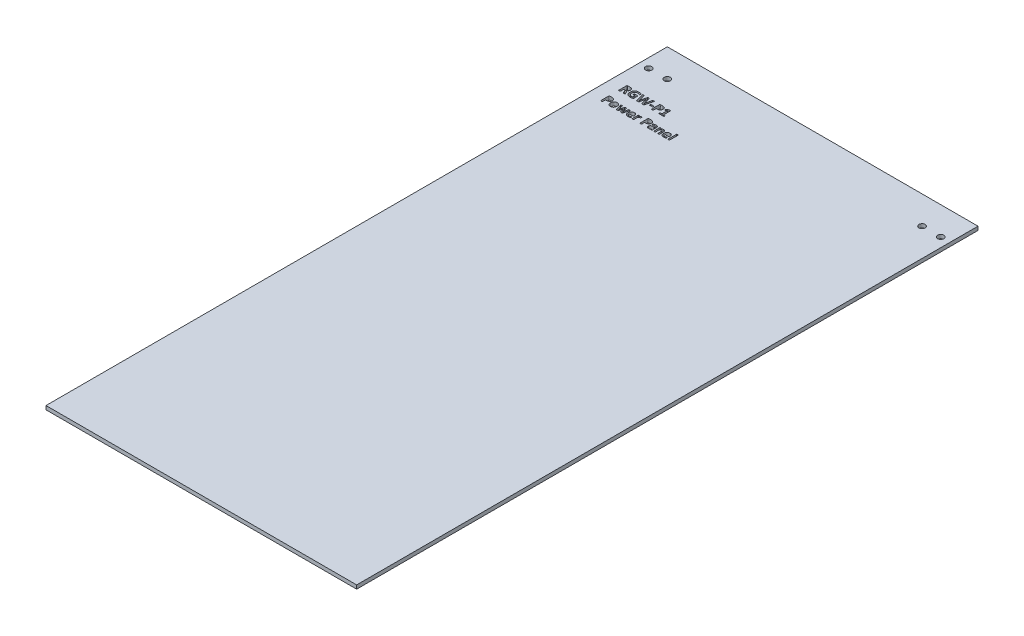
from build123d import *

# Parameters (mm, degrees)
SKETCH_1_W          = 250
SKETCH_1_H          = 500
EXTRUDE_1_DEPTH     = 3
SKETCH_3_R          = 2.5
CUT_EXTRUDE_2_DEPTH = 3
CUT_EXTRUDE_3_DEPTH = 10


with BuildPart() as part:
    # Эскиз1 → Бобышка-Вытянуть1 (new body)
    with BuildSketch(Plane(origin=(0, 0, 0), x_dir=(1, 0, 0), z_dir=(0, 1, 0))):
        Rectangle(SKETCH_1_W, SKETCH_1_H)
    extrude(amount=EXTRUDE_1_DEPTH)

    # Эскиз3 → Вырез-Вытянуть2 (cut)
    with BuildSketch(Plane(origin=(0, 3, 0), x_dir=(1, 0, 0), z_dir=(0, 1, 0))):
        with Locations(Location((-117.5, 227.5, 0), (0, 0, 270))):
            Circle(SKETCH_3_R)
        with Locations(Location((-102.5, 227.5, 0), (0, 0, 270))):
            Circle(SKETCH_3_R)
        with Locations(Location((117.5, 227.5, 0), (0, 0, 270))):
            Circle(SKETCH_3_R)
        with Locations(Location((102.5, 227.5, 0), (0, 0, 270))):
            Circle(SKETCH_3_R)
    extrude(amount=-CUT_EXTRUDE_2_DEPTH, mode=Mode.SUBTRACT)

    # Эскиз4 → Вырез-Вытянуть3 (cut)
    # profile 1 of 16: a face of its own
    with BuildSketch(Plane(origin=(0, 3, 0), x_dir=(1, 0, 0), z_dir=(0, 1, 0))):
        with BuildLine():
            add(Edge.make_bspline(
                [(-109.13247549, 200.210231886), (-109.13306716, 200.192713429), (-109.134195988, 200.15929051), (-109.152130371, 200.111189224), (-109.19322844, 200.069367865), (-109.264771063, 200.042267033), (-109.366972418, 200.021547249), (-109.474713775, 200.010106759), (-109.581841541, 200.003608494), (-109.680479735, 200.003935943), (-109.793169778, 199.998814672), (-109.872758908, 199.999589547), (-109.914917471, 200)],
                knots=[0, 0, 0, 0, 0.591319522, 1.128160102, 1.696130589, 2.518752957, 3.670424272, 5.233177541, 6.180486275, 7.30487453, 8.572385225, 10, 10, 10, 10], degree=3))
            add(Edge.make_bspline(
                [(-109.914917471, 200), (-109.982343269, 200.000997545), (-110.102481163, 200.00277495), (-110.262686899, 200.005855392), (-110.38644804, 200.022292872), (-110.481044425, 200.043665858), (-110.55133829, 200.076297029), (-110.598788039, 200.121001122), (-110.626136035, 200.175403816), (-110.641761327, 200.212793763), (-110.649938725, 200.232361558)],
                knots=[0, 0, 0, 0, 1.94662298, 3.468452578, 4.619005538, 5.544708335, 6.258749361, 6.828725966, 7.387021064, 8, 8, 8, 8], degree=3))
            Line((-110.649938725, 200.232361558), (-111.27589231, 201.76247032))
            add(Edge.make_bspline(
                [(-111.27589231, 201.76247032), (-111.31265192, 201.844973918), (-111.382118779, 202.000885959), (-111.490967966, 202.218232283), (-111.602368583, 202.406494573), (-111.730945385, 202.560236068), (-111.8754059, 202.683276852), (-112.042741433, 202.769897902), (-112.233595653, 202.824446644), (-112.369328977, 202.829784793), (-112.440861481, 202.832598039)],
                knots=[0, 0, 0, 0, 1.274400747, 2.408312201, 3.429775496, 4.353228678, 5.22430954, 6.089020439, 6.992899086, 8, 8, 8, 8], degree=3))
            Line((-112.440861481, 202.832598039), (-112.875551471, 202.832598039))
            Line((-112.875551471, 202.832598039), (-112.875551471, 200.222877413))
            add(Edge.make_bspline(
                [(-112.875551471, 200.222877413), (-112.876875899, 200.20565404), (-112.87957494, 200.170554694), (-112.909443967, 200.122533082), (-112.959148821, 200.082765738), (-113.032259516, 200.054246346), (-113.128587783, 200.031804132), (-113.25217336, 200.01254331), (-113.408100772, 200.002942638), (-113.52309843, 200.001049634), (-113.586862362, 200)],
                knots=[0, 0, 0, 0, 0.508410858, 1.036085586, 1.626982877, 2.379311475, 3.350140591, 4.573428586, 6.100033754, 8, 8, 8, 8], degree=3))
            add(Edge.make_bspline(
                [(-113.586862362, 200), (-113.649041048, 200.001091597), (-113.762974501, 200.003091789), (-113.918412646, 200.012545769), (-114.042946791, 200.031790185), (-114.139697582, 200.053744186), (-114.211367358, 200.083408815), (-114.261773506, 200.12159854), (-114.287138694, 200.171485683), (-114.290284105, 200.205792796), (-114.29185049, 200.222877413)],
                knots=[0, 0, 0, 0, 1.863476628, 3.41455158, 4.660430775, 5.63680735, 6.378967734, 6.973241497, 7.488684008, 8, 8, 8, 8], degree=3))
            Line((-114.29185049, 200.222877413), (-114.29185049, 206.439734605))
            add(Edge.make_bspline(
                [(-114.29185049, 206.439734605), (-114.290301865, 206.475650907), (-114.287375989, 206.543508955), (-114.266859617, 206.637847706), (-114.227383167, 206.715581294), (-114.174167363, 206.776878185), (-114.10952359, 206.822759554), (-114.03789617, 206.856536084), (-113.958782525, 206.875715607), (-113.904155085, 206.877996479), (-113.876128791, 206.879166667)],
                knots=[0, 0, 0, 0, 1.255139882, 2.371383969, 3.342844043, 4.269311035, 5.178797513, 6.092929471, 7.021588424, 8, 8, 8, 8], degree=3))
            Line((-113.876128791, 206.879166667), (-112.09310949, 206.879166667))
            add(Edge.make_bspline(
                [(-112.09310949, 206.879166667), (-112.0498992, 206.879496763), (-111.967153254, 206.880128885), (-111.849160007, 206.875849219), (-111.74319997, 206.873574913), (-111.620963177, 206.866767286), (-111.483286146, 206.858514359), (-111.377030459, 206.847873606), (-111.326474418, 206.842810777)],
                knots=[0, 0, 0, 0, 1.012794642, 1.939460509, 2.767356448, 3.497015972, 4.809089956, 6, 6, 6, 6], degree=3))
            add(Edge.make_bspline(
                [(-111.326474418, 206.842810777), (-111.258909904, 206.83191714), (-111.126228502, 206.810524504), (-110.932932255, 206.767132168), (-110.751219779, 206.709389934), (-110.579552215, 206.643607141), (-110.419297441, 206.565913461), (-110.271063863, 206.477848201), (-110.13464246, 206.379393874), (-110.01328168, 206.268094684), (-109.903236664, 206.147342064), (-109.805902039, 206.016246211), (-109.725544584, 205.87210353), (-109.657283883, 205.71882352), (-109.603296222, 205.554161237), (-109.563406749, 205.37862306), (-109.541876124, 205.190472369), (-109.5387446, 205.061423323), (-109.537132353, 204.99498315)],
                knots=[0, 0, 0, 0, 1.151418638, 2.261125421, 3.329441394, 4.356764664, 5.35198948, 6.322018693, 7.254748064, 8.177310221, 9.087349105, 10.000534908, 10.917628462, 11.858287172, 12.819893749, 13.828610564, 14.882072401, 16, 16, 16, 16], degree=3))
            add(Edge.make_bspline(
                [(-109.537132353, 204.99498315), (-109.537646191, 204.938539335), (-109.538647731, 204.828522779), (-109.558082692, 204.66716672), (-109.582811048, 204.512808011), (-109.623609324, 204.366841098), (-109.672338104, 204.228806275), (-109.731056426, 204.097907655), (-109.800789701, 203.974936264), (-109.879793619, 203.858413487), (-109.970977224, 203.750999219), (-110.070351899, 203.649549072), (-110.180067038, 203.555463446), (-110.34258822, 203.441484595), (-110.567936143, 203.313229841), (-110.765085716, 203.243228372), (-110.866493375, 203.207221775)],
                knots=[0, 0, 0, 0, 0.984128184, 1.918197676, 2.832650415, 3.70915726, 4.55828255, 5.385371142, 6.208721057, 7.022207663, 7.837977017, 8.663633597, 9.498301217, 10.355451789, 12.125356837, 14, 14, 14, 14], degree=3))
            add(Edge.make_bspline(
                [(-110.866493375, 203.207221775), (-110.81473546, 203.180945441), (-110.711193999, 203.128379761), (-110.566716328, 203.028732308), (-110.429426592, 202.912122462), (-110.303495545, 202.77093389), (-110.18341042, 202.609603661), (-110.070907532, 202.425463323), (-109.963284065, 202.218454334), (-109.897261821, 202.07055314), (-109.862754672, 201.993251187)],
                knots=[0, 0, 0, 0, 0.862491229, 1.725409574, 2.603460875, 3.535458815, 4.5322819, 5.591415034, 6.741130359, 8, 8, 8, 8], degree=3))
            Line((-109.862754672, 201.993251187), (-109.268414905, 200.648083257))
            add(Edge.make_bspline(
                [(-109.268414905, 200.648083257), (-109.255593077, 200.617065396), (-109.232003961, 200.559999901), (-109.201908661, 200.480247938), (-109.177887679, 200.413923368), (-109.156216323, 200.346830699), (-109.137433372, 200.280811916), (-109.133962843, 200.231405731), (-109.13247549, 200.210231886)],
                knots=[0, 0, 0, 0, 1.311865282, 2.41352042, 3.332073222, 4.068080627, 5.172043703, 6, 6, 6, 6], degree=3))
        make_face()
        with BuildLine():
            add(Edge.make_bspline(
                [(-110.953431373, 204.817945772), (-110.95498663, 204.871842609), (-110.958001625, 204.976326119), (-110.988772989, 205.126016362), (-111.038068579, 205.262503487), (-111.106337488, 205.386562215), (-111.197689701, 205.496088728), (-111.314904419, 205.587936603), (-111.457460555, 205.660654885), (-111.563481122, 205.692702748), (-111.618902229, 205.709455423)],
                knots=[0, 0, 0, 0, 1.06541259, 2.065391104, 3.008807556, 3.928413024, 4.853617449, 5.811161198, 6.855808141, 8, 8, 8, 8], degree=3))
            add(Edge.make_bspline(
                [(-111.618902229, 205.709455423), (-111.657265087, 205.717891776), (-111.73821668, 205.735693791), (-111.845196905, 205.749581689), (-111.942914202, 205.757120952), (-112.030798333, 205.764824347), (-112.13211811, 205.764417611), (-112.203764465, 205.765687832), (-112.241694432, 205.766360294)],
                knots=[0, 0, 0, 0, 1.127497783, 2.379195572, 3.092833242, 3.942220738, 4.910600581, 6, 6, 6, 6], degree=3))
            Line((-112.241694432, 205.766360294), (-112.875551471, 205.766360294))
            Line((-112.875551471, 205.766360294), (-112.875551471, 203.844240196))
            Line((-112.875551471, 203.844240196), (-112.156337125, 203.844240196))
            add(Edge.make_bspline(
                [(-112.156337125, 203.844240196), (-112.107838906, 203.845243072), (-112.013833855, 203.847186965), (-111.876909388, 203.859539645), (-111.749622108, 203.881615622), (-111.63087782, 203.911338275), (-111.522703781, 203.950872383), (-111.423040013, 203.99703423), (-111.333282271, 204.050249899), (-111.227386353, 204.130400376), (-111.117414378, 204.249723369), (-111.021560801, 204.419461908), (-110.963480539, 204.611909721), (-110.956843397, 204.747989713), (-110.953431373, 204.817945772)],
                knots=[0, 0, 0, 0, 0.997048219, 1.932598153, 2.822976353, 3.650522851, 4.445456231, 5.186855846, 5.905759209, 6.586005233, 7.91212848, 9.207278324, 10.564316464, 12, 12, 12, 12], degree=3))
        make_face(mode=Mode.SUBTRACT)
    # profile 2 of 16: a face of its own
    with BuildSketch(Plane(origin=(0, 3, 0), x_dir=(1, 0, 0), z_dir=(0, 1, 0))):
        with BuildLine():
            add(Edge.make_bspline(
                [(-102.556801471, 205.83116862), (-102.557124177, 205.782664382), (-102.55772501, 205.692356459), (-102.569030482, 205.568331007), (-102.584238651, 205.466284101), (-102.6032163, 205.38595003), (-102.629430569, 205.326653008), (-102.662605593, 205.286351712), (-102.703533478, 205.26351946), (-102.733046046, 205.261544353), (-102.748065066, 205.260539216)],
                knots=[0, 0, 0, 0, 1.779742485, 3.313624891, 4.56643279, 5.565606573, 6.335589998, 6.925077498, 7.452969254, 8, 8, 8, 8], degree=3))
            add(Edge.make_bspline(
                [(-102.748065066, 205.260539216), (-102.761336234, 205.262207914), (-102.792344514, 205.266106853), (-102.843289539, 205.285324563), (-102.904547558, 205.315961241), (-102.976517003, 205.357516659), (-103.059309359, 205.406592681), (-103.154214421, 205.459815575), (-103.264110083, 205.510465385), (-103.385056445, 205.566489132), (-103.518707101, 205.621594841), (-103.665477074, 205.67389276), (-103.824435036, 205.723595278), (-103.995085254, 205.773469145), (-104.179178489, 205.817499763), (-104.378046605, 205.84637986), (-104.591361977, 205.863841115), (-104.738118951, 205.866268804), (-104.814028033, 205.86752451)],
                knots=[0, 0, 0, 0, 0.293685536, 0.686200562, 1.189426888, 1.802357413, 2.514593901, 3.30891054, 4.196130853, 5.177264142, 6.243570253, 7.377336262, 8.606321647, 9.909696198, 11.291251308, 12.769360231, 14.328972786, 16, 16, 16, 16], degree=3))
            add(Edge.make_bspline(
                [(-104.814028033, 205.86752451), (-104.895792485, 205.8653402), (-105.055736016, 205.861067362), (-105.289476737, 205.829375143), (-105.510596158, 205.774996948), (-105.719953357, 205.701622077), (-105.91414089, 205.605294371), (-106.097137627, 205.495218513), (-106.262369854, 205.362508403), (-106.415555424, 205.215436312), (-106.551725638, 205.050416476), (-106.670573032, 204.868687565), (-106.773726205, 204.671970251), (-106.859271096, 204.459708825), (-106.92422104, 204.233732088), (-106.974607933, 203.996267736), (-107.002569139, 203.74691276), (-107.00618869, 203.576641521), (-107.008026961, 203.490165441)],
                knots=[0, 0, 0, 0, 1.076967449, 2.106709871, 3.099966825, 4.07253887, 5.022456054, 5.951008492, 6.880027787, 7.807775643, 8.744490201, 9.691664596, 10.663443716, 11.666234842, 12.700738564, 13.757109582, 14.860897639, 16, 16, 16, 16], degree=3))
            add(Edge.make_bspline(
                [(-107.008026961, 203.490165441), (-107.006485102, 203.395757308), (-107.003487727, 203.212227851), (-106.97225185, 202.945376486), (-106.924578647, 202.695477138), (-106.85597801, 202.46341387), (-106.771452473, 202.248955471), (-106.667547433, 202.053863311), (-106.550545951, 201.875185121), (-106.417414127, 201.714536485), (-106.26805005, 201.57309183), (-106.103904607, 201.451328529), (-105.927260852, 201.345253575), (-105.735271256, 201.260584457), (-105.531231368, 201.194417061), (-105.316845476, 201.147235642), (-105.092514725, 201.11793807), (-104.939520919, 201.114540261), (-104.861448759, 201.112806373)],
                knots=[0, 0, 0, 0, 1.248401375, 2.426892903, 3.549213023, 4.61011075, 5.623602293, 6.593314215, 7.529010186, 8.444682358, 9.346991799, 10.243385632, 11.143538627, 12.067135642, 13.012774429, 13.976732377, 14.967534192, 16, 16, 16, 16], degree=3))
            add(Edge.make_bspline(
                [(-104.861448759, 201.112806373), (-104.783828884, 201.11523674), (-104.628197955, 201.120109724), (-104.398788839, 201.159530214), (-104.177141807, 201.219598235), (-104.040322139, 201.28366017), (-103.97310049, 201.315134804)],
                knots=[0, 0, 0, 0, 1.012831231, 2.030766797, 3.032484847, 4, 4, 4, 4], degree=3))
            Line((-103.97310049, 201.315134804), (-103.97310049, 202.832598039))
            Line((-103.97310049, 202.832598039), (-105.286654603, 202.832598039))
            add(Edge.make_bspline(
                [(-105.286654603, 202.832598039), (-105.302317383, 202.834002277), (-105.333497576, 202.83679772), (-105.374926594, 202.863901646), (-105.410997902, 202.903844394), (-105.440697543, 202.961389989), (-105.464324594, 203.037683449), (-105.477757293, 203.134697076), (-105.489945606, 203.252762065), (-105.490345691, 203.338898192), (-105.490563725, 203.385839844)],
                knots=[0, 0, 0, 0, 0.580621149, 1.155853587, 1.798225935, 2.583977938, 3.557384326, 4.776998391, 6.243559103, 8, 8, 8, 8], degree=3))
            add(Edge.make_bspline(
                [(-105.490563725, 203.385839844), (-105.490033077, 203.433801648), (-105.489063789, 203.521409128), (-105.480544528, 203.64148263), (-105.463941835, 203.738624078), (-105.440344649, 203.815346442), (-105.411405249, 203.873806704), (-105.374720757, 203.914660407), (-105.332686878, 203.940589327), (-105.301720825, 203.943828449), (-105.286654603, 203.945404412)],
                knots=[0, 0, 0, 0, 1.779056255, 3.249640816, 4.461137152, 5.425418379, 6.221036523, 6.857386976, 7.444073105, 8, 8, 8, 8], degree=3))
            Line((-105.286654603, 203.945404412), (-102.933005898, 203.945404412))
            add(Edge.make_bspline(
                [(-102.933005898, 203.945404412), (-102.905957149, 203.943938762), (-102.854032771, 203.941125214), (-102.780628083, 203.91800926), (-102.715855418, 203.880850958), (-102.659681529, 203.829136678), (-102.613381342, 203.76364347), (-102.580772239, 203.68479676), (-102.559359573, 203.594559117), (-102.557684635, 203.53034641), (-102.556801471, 203.496488205)],
                knots=[0, 0, 0, 0, 0.982918048, 1.886867671, 2.771897237, 3.68152703, 4.644784731, 5.667328686, 6.770024384, 8, 8, 8, 8], degree=3))
            Line((-102.556801471, 203.496488205), (-102.556801471, 200.747666782))
            add(Edge.make_bspline(
                [(-102.556801471, 200.747666782), (-102.559261033, 200.697305326), (-102.563945746, 200.601382161), (-102.600326188, 200.487299598), (-102.646974517, 200.408297831), (-102.697986521, 200.356694932), (-102.763921347, 200.312676287), (-102.876848612, 200.26108528), (-103.046950759, 200.201666965), (-103.275988663, 200.128913226), (-103.531036973, 200.060377247), (-103.799558479, 200.002449187), (-104.074402434, 199.95663234), (-104.352387488, 199.923853862), (-104.632426436, 199.90203972), (-104.819783375, 199.8999049), (-104.913611558, 199.898835784)],
                knots=[0, 0, 0, 0, 0.779523987, 1.484754705, 1.829402625, 2.193356138, 2.598933889, 3.051997129, 4.11424195, 5.39053249, 6.777617393, 8.206831602, 9.647833393, 11.095764893, 12.545561736, 14, 14, 14, 14], degree=3))
            add(Edge.make_bspline(
                [(-104.913611558, 199.898835784), (-105.047571025, 199.901302657), (-105.308884952, 199.906114769), (-105.690242713, 199.951293781), (-106.049954661, 200.025105517), (-106.387959218, 200.127427066), (-106.702243765, 200.258527462), (-106.991527896, 200.417798503), (-107.257722178, 200.601208825), (-107.497186481, 200.813120425), (-107.712503023, 201.048932951), (-107.897085367, 201.313009525), (-108.059871224, 201.597767907), (-108.192363532, 201.908235134), (-108.297029141, 202.241228883), (-108.36980514, 202.59719941), (-108.41755583, 202.974090173), (-108.422034593, 203.232887226), (-108.42432598, 203.365290862)],
                knots=[0, 0, 0, 0, 1.148845011, 2.241045058, 3.288887578, 4.295517503, 5.265966589, 6.204640585, 7.12374905, 8.03330445, 8.942140727, 9.856446029, 10.791630842, 11.751367401, 12.746381073, 13.780948361, 14.864706909, 16, 16, 16, 16], degree=3))
            add(Edge.make_bspline(
                [(-108.42432598, 203.365290862), (-108.421400146, 203.502417558), (-108.415687574, 203.770151852), (-108.367977374, 204.160833953), (-108.287146866, 204.528930429), (-108.176739436, 204.875415266), (-108.036011891, 205.198341624), (-107.867862502, 205.496925228), (-107.674241017, 205.770962735), (-107.453647872, 206.019152545), (-107.205642391, 206.239228568), (-106.933752434, 206.433051953), (-106.638301841, 206.599846042), (-106.319052033, 206.737165192), (-105.978646692, 206.845951205), (-105.618993733, 206.925226462), (-105.239907589, 206.971277505), (-104.981180704, 206.977266577), (-104.848803232, 206.980330882)],
                knots=[0, 0, 0, 0, 1.145734837, 2.237000644, 3.282985912, 4.291204874, 5.271269321, 6.221632334, 7.150200055, 8.07026128, 8.990322505, 9.91530208, 10.855831065, 11.820269797, 12.814564795, 13.838101092, 14.893865585, 16, 16, 16, 16], degree=3))
            add(Edge.make_bspline(
                [(-104.848803232, 206.980330882), (-104.776072444, 206.979922613), (-104.634208872, 206.979126272), (-104.426536404, 206.967156537), (-104.22865482, 206.950792753), (-104.041125021, 206.924883811), (-103.864101441, 206.894829216), (-103.698026596, 206.861754132), (-103.543416073, 206.825872375), (-103.360129797, 206.77479546), (-103.159180137, 206.707426739), (-102.981132565, 206.62854393), (-102.864015912, 206.564287183), (-102.793995987, 206.522075235), (-102.738184306, 206.482212853), (-102.678272265, 206.433292803), (-102.620643295, 206.352811949), (-102.590491455, 206.252267178), (-102.57200469, 206.15470933), (-102.563921035, 206.061541975), (-102.556976399, 205.951934975), (-102.556862551, 205.873337402), (-102.556801471, 205.83116862)],
                knots=[0, 0, 0, 0, 1.505040081, 2.935625551, 4.30401116, 5.61337645, 6.852179823, 8.019874615, 9.117596685, 10.136202362, 11.957033868, 13.499418369, 14.158242969, 14.721195766, 15.190235072, 15.577014793, 16.318631053, 17.194563379, 17.72712218, 18.373832153, 19.127536457, 20, 20, 20, 20], degree=3))
        make_face()
    # profile 3 of 16: a face of its own
    with BuildSketch(Plane(origin=(0, 3, 0), x_dir=(1, 0, 0), z_dir=(0, 1, 0))):
        with BuildLine():
            add(Edge.make_bspline(
                [(-93.880389285, 200.384107881), (-93.891725363, 200.345745009), (-93.912622028, 200.275027774), (-93.961756758, 200.179798776), (-94.037281933, 200.108661225), (-94.139107244, 200.059758759), (-94.268736633, 200.028746829), (-94.430410805, 200.009110299), (-94.631149258, 200.001717888), (-94.778749362, 200.000611933), (-94.860417624, 200)],
                knots=[0, 0, 0, 0, 0.828472167, 1.527186518, 2.191185698, 2.938119969, 3.840992575, 4.941785944, 6.307866865, 8, 8, 8, 8], degree=3))
            add(Edge.make_bspline(
                [(-94.860417624, 200), (-94.907835162, 200.000625676), (-94.997929103, 200.001814468), (-95.126036718, 200.001983616), (-95.239249324, 200.008012706), (-95.364583828, 200.012288857), (-95.494295648, 200.028539928), (-95.623244879, 200.058799155), (-95.720593141, 200.10829075), (-95.787765253, 200.18119562), (-95.830010952, 200.275675522), (-95.846986524, 200.345819068), (-95.856252872, 200.384107881)],
                knots=[0, 0, 0, 0, 1.200390798, 2.280758157, 3.241844714, 4.069696988, 5.454290943, 6.544491945, 7.409847109, 8.174247725, 9.003388151, 10, 10, 10, 10], degree=3))
            Line((-95.856252872, 200.384107881), (-96.931122664, 204.704136029))
            Line((-96.931122664, 204.704136029), (-96.9421875, 204.704136029))
            Line((-96.9421875, 204.704136029), (-98.005992456, 200.384107881))
            add(Edge.make_bspline(
                [(-98.005992456, 200.384107881), (-98.015238627, 200.347337771), (-98.032542997, 200.278521866), (-98.076753136, 200.186225019), (-98.14306757, 200.110891278), (-98.241300029, 200.061142486), (-98.369124139, 200.027756112), (-98.498221838, 200.012350909), (-98.621936098, 200.008067197), (-98.73410063, 200.001919353), (-98.860627855, 200.001839202), (-98.950194927, 200.000632001), (-98.997085631, 200)],
                knots=[0, 0, 0, 0, 0.964606664, 1.805278237, 2.584746217, 3.474186178, 4.562364076, 5.943010412, 6.776466711, 7.71722888, 8.804909628, 10, 10, 10, 10], degree=3))
            add(Edge.make_bspline(
                [(-98.997085631, 200), (-99.046610886, 200.000625088), (-99.139866587, 200.001802124), (-99.272186223, 200.001990174), (-99.388565131, 200.008026224), (-99.517040056, 200.012255123), (-99.649468271, 200.028276507), (-99.780673327, 200.059300341), (-99.880501055, 200.107762998), (-99.949776253, 200.180986851), (-99.993155744, 200.275960194), (-100.013440237, 200.345870781), (-100.024534697, 200.384107881)],
                knots=[0, 0, 0, 0, 1.226427643, 2.309354474, 3.275578471, 4.111462609, 5.491790153, 6.570859358, 7.440377765, 8.197066898, 9.013898509, 10, 10, 10, 10], degree=3))
            Line((-100.024534697, 200.384107881), (-101.595741422, 206.330666935))
            add(Edge.make_bspline(
                [(-101.595741422, 206.330666935), (-101.60274055, 206.360667664), (-101.615844102, 206.416834098), (-101.632070057, 206.496342484), (-101.64288178, 206.565541106), (-101.652678855, 206.640143638), (-101.646446807, 206.723359223), (-101.599538658, 206.787762329), (-101.5485503, 206.82386976), (-101.497820367, 206.842958657), (-101.437268409, 206.857377548), (-101.365672282, 206.865992243), (-101.280731128, 206.871832021), (-101.181658252, 206.877004337), (-101.067785026, 206.877413229), (-100.987173217, 206.878559711), (-100.944496783, 206.879166667)],
                knots=[0, 0, 0, 0, 1.131713364, 2.118758674, 2.981202209, 3.70160486, 4.892526967, 5.934423668, 6.503746327, 7.172352893, 7.90946648, 8.788265191, 9.817133147, 11.038040768, 12.431918871, 14, 14, 14, 14], degree=3))
            add(Edge.make_bspline(
                [(-100.944496783, 206.879166667), (-100.904979269, 206.879267474), (-100.829628667, 206.879459689), (-100.723703413, 206.878184174), (-100.630446599, 206.874479203), (-100.529710408, 206.871042227), (-100.427433545, 206.86417786), (-100.331374544, 206.838642135), (-100.260871963, 206.804636454), (-100.217040863, 206.749059761), (-100.195478357, 206.676832115), (-100.185213392, 206.624220623), (-100.179442402, 206.59464231)],
                knots=[0, 0, 0, 0, 1.288700235, 2.457248118, 3.454435296, 4.331425027, 5.747093502, 6.780913502, 7.565316964, 8.249610182, 9.015926434, 10, 10, 10, 10], degree=3))
            Line((-100.179442402, 206.59464231), (-98.965471814, 201.375201057))
            Line((-98.965471814, 201.375201057), (-98.960729741, 201.375201057))
            Line((-98.960729741, 201.375201057), (-97.680370136, 206.55828642))
            add(Edge.make_bspline(
                [(-97.680370136, 206.55828642), (-97.673251706, 206.588505878), (-97.660075341, 206.644442737), (-97.629853066, 206.721289837), (-97.578513694, 206.781834784), (-97.502533527, 206.823545981), (-97.402445161, 206.852432775), (-97.300198068, 206.863878244), (-97.202039042, 206.871908481), (-97.112434499, 206.876934683), (-97.0106793, 206.877433483), (-96.939024156, 206.878566723), (-96.901089537, 206.879166667)],
                knots=[0, 0, 0, 0, 0.991997648, 1.836208739, 2.612054163, 3.472220261, 4.563607158, 5.922711611, 6.750146941, 7.710810409, 8.788090707, 10, 10, 10, 10], degree=3))
            add(Edge.make_bspline(
                [(-96.901089537, 206.879166667), (-96.86104011, 206.879493724), (-96.784614748, 206.880117841), (-96.677161354, 206.875968674), (-96.582257129, 206.873466951), (-96.478827557, 206.867432626), (-96.371891509, 206.857503153), (-96.268125858, 206.829868212), (-96.189940859, 206.788692592), (-96.139912144, 206.72574523), (-96.106208544, 206.648150651), (-96.092827999, 206.590217446), (-96.085453048, 206.55828642)],
                knots=[0, 0, 0, 0, 1.228277533, 2.343892593, 3.297971527, 4.139769378, 5.522974951, 6.58189546, 7.42182955, 8.179183829, 8.996421316, 10, 10, 10, 10], degree=3))
            Line((-96.085453048, 206.55828642), (-94.817738971, 201.375201057))
            Line((-94.817738971, 201.375201057), (-94.806674134, 201.375201057))
            Line((-94.806674134, 201.375201057), (-93.603768382, 206.578835401))
            add(Edge.make_bspline(
                [(-93.603768382, 206.578835401), (-93.597813879, 206.604739609), (-93.586595338, 206.653544256), (-93.564603838, 206.723100454), (-93.523772784, 206.783753255), (-93.452458079, 206.823205097), (-93.357859075, 206.853336953), (-93.25780225, 206.863816164), (-93.1597017, 206.871995979), (-93.06796827, 206.87696738), (-92.962004435, 206.877429943), (-92.886660122, 206.878563973), (-92.846617456, 206.879166667)],
                knots=[0, 0, 0, 0, 0.875411882, 1.649313821, 2.395684222, 3.214212243, 4.273299352, 5.657392683, 6.510506289, 7.518311766, 8.681076133, 10, 10, 10, 10], degree=3))
            add(Edge.make_bspline(
                [(-92.846617456, 206.879166667), (-92.809209602, 206.878560781), (-92.738607975, 206.877417264), (-92.638960638, 206.876994774), (-92.552502554, 206.871879559), (-92.460807359, 206.864458881), (-92.367759056, 206.850167775), (-92.280452522, 206.801419776), (-92.23154967, 206.719163508), (-92.230967785, 206.635310922), (-92.239635984, 206.55814971), (-92.250509265, 206.48617702), (-92.269019228, 206.404405956), (-92.281822466, 206.345954985), (-92.288633578, 206.314860026)],
                knots=[0, 0, 0, 0, 1.252588424, 2.364069893, 3.33573087, 4.150248658, 5.447623475, 6.461137435, 7.386877247, 8.501713295, 9.193295655, 9.996657773, 10.934254751, 12, 12, 12, 12], degree=3))
            Line((-92.288633578, 206.314860026), (-93.880389285, 200.384107881))
        make_face()
    # profile 4 of 16: a face of its own
    with BuildSketch(Plane(origin=(0, 3, 0), x_dir=(1, 0, 0), z_dir=(0, 1, 0))):
        with BuildLine():
            add(Edge.make_bspline(
                [(-88.899632353, 202.685593788), (-88.899964611, 202.637088069), (-88.90057244, 202.548352308), (-88.911370002, 202.426759873), (-88.928708495, 202.328138841), (-88.955370335, 202.251711323), (-88.98905321, 202.193460398), (-89.033766937, 202.154246511), (-89.086785807, 202.128184022), (-89.125880423, 202.125726895), (-89.146220129, 202.124448529)],
                knots=[0, 0, 0, 0, 1.70714895, 3.123037127, 4.294581022, 5.221789102, 5.96315644, 6.63332839, 7.288963511, 8, 8, 8, 8], degree=3))
            Line((-89.146220129, 202.124448529), (-91.378155637, 202.124448529))
            add(Edge.make_bspline(
                [(-91.378155637, 202.124448529), (-91.399529144, 202.125687479), (-91.44012236, 202.128040528), (-91.495818151, 202.1540527), (-91.541390768, 202.195188825), (-91.577568601, 202.254134016), (-91.600720154, 202.33245064), (-91.619882557, 202.430273827), (-91.629871077, 202.550516354), (-91.630646521, 202.63816174), (-91.631066176, 202.685593788)],
                knots=[0, 0, 0, 0, 0.742130552, 1.409476935, 2.100526384, 2.861596483, 3.793076646, 4.9376098, 6.342691551, 8, 8, 8, 8], degree=3))
            add(Edge.make_bspline(
                [(-91.631066176, 202.685593788), (-91.63066376, 202.732506415), (-91.629920842, 202.819113949), (-91.619761509, 202.937702398), (-91.601237092, 203.033713747), (-91.576715883, 203.109812478), (-91.541964653, 203.168199282), (-91.495233446, 203.207511421), (-91.44019632, 203.233744211), (-91.399554655, 203.236043997), (-91.378155637, 203.237254902)],
                knots=[0, 0, 0, 0, 1.66002107, 3.064640367, 4.20563049, 5.113809181, 5.884686017, 6.572361307, 7.248306755, 8, 8, 8, 8], degree=3))
            Line((-91.378155637, 203.237254902), (-89.146220129, 203.237254902))
            add(Edge.make_bspline(
                [(-89.146220129, 203.237254902), (-89.12595285, 203.236433343), (-89.087855288, 203.234889011), (-89.03482735, 203.212217674), (-88.989767002, 203.173857337), (-88.955573797, 203.11474444), (-88.926474908, 203.037696632), (-88.912294262, 202.938352093), (-88.900361944, 202.819207135), (-88.899888696, 202.732539156), (-88.899632353, 202.685593788)],
                knots=[0, 0, 0, 0, 0.715517841, 1.344999761, 2.009177568, 2.783309658, 3.743277578, 4.922418291, 6.332969005, 8, 8, 8, 8], degree=3))
        make_face()
    # profile 5 of 16: a face of its own
    with BuildSketch(Plane(origin=(0, 3, 0), x_dir=(1, 0, 0), z_dir=(0, 1, 0))):
        with BuildLine():
            add(Edge.make_bspline(
                [(-83.133272059, 204.808461627), (-83.135114287, 204.715602113), (-83.138707879, 204.53446317), (-83.174868815, 204.271023164), (-83.230307371, 204.023178527), (-83.311710766, 203.792967781), (-83.41358029, 203.579560748), (-83.534636983, 203.381831753), (-83.680905205, 203.204511166), (-83.843608765, 203.041656657), (-84.028680468, 202.898762208), (-84.234395359, 202.775183521), (-84.459784353, 202.66963674), (-84.704540225, 202.580753799), (-84.970044828, 202.510978274), (-85.257903893, 202.463306322), (-85.567916354, 202.432459444), (-85.782431087, 202.429479401), (-85.893158318, 202.427941176)],
                knots=[0, 0, 0, 0, 1.074464578, 2.095933629, 3.072557769, 4.010187366, 4.916045523, 5.806428764, 6.686724732, 7.570985258, 8.466598065, 9.386175178, 10.343966936, 11.343562976, 12.397043313, 13.517236352, 14.718458445, 16, 16, 16, 16], degree=3))
            Line((-85.893158318, 202.427941176), (-86.471691176, 202.427941176))
            Line((-86.471691176, 202.427941176), (-86.471691176, 200.224458104))
            add(Edge.make_bspline(
                [(-86.471691176, 200.224458104), (-86.473018227, 200.207240605), (-86.475722609, 200.172153229), (-86.505548739, 200.124035492), (-86.555623941, 200.084584235), (-86.627908285, 200.053658813), (-86.724834518, 200.032044643), (-86.84827337, 200.012454105), (-87.004254406, 200.002973936), (-87.119243104, 200.001060798), (-87.183002068, 200)],
                knots=[0, 0, 0, 0, 0.508007, 1.035262567, 1.625690476, 2.383776293, 3.353834227, 4.576150498, 6.101543, 8, 8, 8, 8], degree=3))
            add(Edge.make_bspline(
                [(-87.183002068, 200), (-87.245180753, 200.001091597), (-87.359114207, 200.003091789), (-87.514552351, 200.012545769), (-87.639086497, 200.031790185), (-87.735837288, 200.053744186), (-87.807507064, 200.083408815), (-87.857913212, 200.12159854), (-87.8832784, 200.171485683), (-87.886423811, 200.205792796), (-87.887990196, 200.222877413)],
                knots=[0, 0, 0, 0, 1.863476628, 3.41455158, 4.660430775, 5.63680735, 6.378967734, 6.973241497, 7.488684008, 8, 8, 8, 8], degree=3))
            Line((-87.887990196, 200.222877413), (-87.887990196, 206.381249043))
            add(Edge.make_bspline(
                [(-87.887990196, 206.381249043), (-87.886841476, 206.420411379), (-87.884671022, 206.494406824), (-87.858854195, 206.597418667), (-87.817932733, 206.685474652), (-87.758988472, 206.756678998), (-87.687766274, 206.812495933), (-87.604171932, 206.8506322), (-87.511085699, 206.875297599), (-87.445039449, 206.877841167), (-87.410621553, 206.879166667)],
                knots=[0, 0, 0, 0, 1.197727496, 2.263051323, 3.230895321, 4.148959142, 5.069575903, 5.97979471, 6.947234457, 8, 8, 8, 8], degree=3))
            Line((-87.410621553, 206.879166667), (-85.773025812, 206.879166667))
            add(Edge.make_bspline(
                [(-85.773025812, 206.879166667), (-85.692910566, 206.878351258), (-85.536237425, 206.876756648), (-85.340780235, 206.863788091), (-85.182585595, 206.849779407), (-85.055172106, 206.831595433), (-84.916462757, 206.809549188), (-84.768154645, 206.781482031), (-84.612733819, 206.74673956), (-84.455152819, 206.697201115), (-84.297164904, 206.63321001), (-84.139404569, 206.558615038), (-83.986348502, 206.472746182), (-83.844218552, 206.374031028), (-83.711330179, 206.266962535), (-83.5933458, 206.146077437), (-83.486361591, 206.015865899), (-83.392692864, 205.874713758), (-83.313230345, 205.722103727), (-83.249241139, 205.558508947), (-83.196032606, 205.386060894), (-83.160528755, 205.202694324), (-83.137820562, 205.009253638), (-83.134813282, 204.876498375), (-83.133272059, 204.808461627)],
                knots=[0, 0, 0, 0, 1.38621072, 2.710869615, 3.388616039, 4.133955867, 4.937429859, 5.819054405, 6.745780206, 7.69168535, 8.673727408, 9.693358198, 10.710090274, 11.706587263, 12.684939732, 13.6585218, 14.624043424, 15.597668188, 16.584608242, 17.59543571, 18.633851017, 19.703190502, 20.822890724, 22, 22, 22, 22], degree=3))
        make_face()
        with BuildLine():
            add(Edge.make_bspline(
                [(-84.650735294, 204.707297411), (-84.652122838, 204.762189558), (-84.654792073, 204.867786193), (-84.678609156, 205.018573851), (-84.717315176, 205.154615497), (-84.773622807, 205.27407153), (-84.840476882, 205.378052081), (-84.912686873, 205.469665057), (-84.994478357, 205.545222264), (-85.11233266, 205.623672939), (-85.269967473, 205.697171118), (-85.471231389, 205.74192409), (-85.676610909, 205.763182491), (-85.815126664, 205.765292189), (-85.885254864, 205.766360294)],
                knots=[0, 0, 0, 0, 1.056493055, 2.032387488, 2.931402208, 3.771204896, 4.564998665, 5.308217722, 6.011945206, 6.698641516, 8.028848972, 9.333224699, 10.649856469, 12, 12, 12, 12], degree=3))
            Line((-85.885254864, 205.766360294), (-86.471691176, 205.766360294))
            Line((-86.471691176, 205.766360294), (-86.471691176, 203.540747549))
            Line((-86.471691176, 203.540747549), (-85.853641046, 203.540747549))
            add(Edge.make_bspline(
                [(-85.853641046, 203.540747549), (-85.800871723, 203.541180683), (-85.699754511, 203.54201066), (-85.555316346, 203.561421341), (-85.422780027, 203.584438533), (-85.303829827, 203.623157185), (-85.196316458, 203.670986687), (-85.099759579, 203.727738292), (-85.013563579, 203.793298932), (-84.911186432, 203.890667665), (-84.807687398, 204.037745149), (-84.717385826, 204.239516737), (-84.661045115, 204.466160485), (-84.654241163, 204.625298464), (-84.650735294, 204.707297411)],
                knots=[0, 0, 0, 0, 0.994866053, 1.906374308, 2.74693753, 3.530006713, 4.260007552, 4.964362092, 5.63858968, 6.299709843, 7.624490497, 8.999703561, 10.454038735, 12, 12, 12, 12], degree=3))
        make_face(mode=Mode.SUBTRACT)
    # profile 6 of 16: a face of its own
    with BuildSketch(Plane(origin=(0, 3, 0), x_dir=(1, 0, 0), z_dir=(0, 1, 0))):
        with BuildLine():
            add(Edge.make_bspline(
                [(-77.771568627, 200.548499732), (-77.771682264, 200.501025561), (-77.771891111, 200.413774975), (-77.785284955, 200.294483906), (-77.802268023, 200.196855827), (-77.829067543, 200.121261628), (-77.860606282, 200.064649866), (-77.897780825, 200.026449831), (-77.940422226, 200.002871594), (-77.970974754, 200.000969301), (-77.986542586, 200)],
                knots=[0, 0, 0, 0, 1.769380938, 3.251863504, 4.473793643, 5.456147252, 6.231459106, 6.87077347, 7.424610359, 8, 8, 8, 8], degree=3))
            Line((-77.986542586, 200), (-81.811814491, 200))
            add(Edge.make_bspline(
                [(-81.811814491, 200), (-81.825732499, 200.001208957), (-81.854559017, 200.003712909), (-81.895766668, 200.025999926), (-81.931263739, 200.065315559), (-81.963114307, 200.121131672), (-81.989617257, 200.196912648), (-82.007278235, 200.294368077), (-82.017542976, 200.413924001), (-82.01943529, 200.501055282), (-82.020465686, 200.548499732)],
                knots=[0, 0, 0, 0, 0.521835169, 1.080807807, 1.712179375, 2.494680724, 3.486143732, 4.719404872, 6.213660719, 8, 8, 8, 8], degree=3))
            add(Edge.make_bspline(
                [(-82.020465686, 200.548499732), (-82.019847873, 200.596971311), (-82.018718226, 200.685599731), (-82.011182688, 200.807015547), (-81.991938179, 200.90492914), (-81.967693126, 200.982677363), (-81.935943345, 201.041313045), (-81.899421366, 201.083538901), (-81.855337064, 201.107948165), (-81.82419651, 201.111188835), (-81.80865311, 201.112806373)],
                knots=[0, 0, 0, 0, 1.773338699, 3.242481697, 4.440534656, 5.415572, 6.2091949, 6.863837362, 7.432899261, 8, 8, 8, 8], degree=3))
            Line((-81.80865311, 201.112806373), (-80.503002451, 201.112806373))
            Line((-80.503002451, 201.112806373), (-80.503002451, 205.462867647))
            Line((-80.503002451, 205.462867647), (-81.618970205, 204.855882353))
            add(Edge.make_bspline(
                [(-81.618970205, 204.855882353), (-81.656079823, 204.839372027), (-81.721229868, 204.810386321), (-81.811246422, 204.78059282), (-81.887780024, 204.778168936), (-81.951059216, 204.812964886), (-81.987607532, 204.88535551), (-82.009560909, 204.986699568), (-82.017265299, 205.127188664), (-82.019302828, 205.234226032), (-82.020465686, 205.295314415)],
                knots=[0, 0, 0, 0, 1.16110972, 2.038456742, 2.701448753, 3.288176025, 3.990880841, 4.937165991, 6.251978929, 8, 8, 8, 8], degree=3))
            add(Edge.make_bspline(
                [(-82.020465686, 205.295314415), (-82.019988274, 205.334833111), (-82.019128755, 205.405981512), (-82.017288066, 205.503643347), (-82.008896125, 205.584005937), (-81.991009011, 205.651010184), (-81.96696176, 205.707268963), (-81.930375865, 205.753094391), (-81.883321527, 205.793630998), (-81.847376671, 205.818875144), (-81.8276214, 205.832749311)],
                knots=[0, 0, 0, 0, 1.56313437, 2.814225196, 3.86369772, 4.748352527, 5.550351806, 6.263187403, 7.045448883, 8, 8, 8, 8], degree=3))
            Line((-81.8276214, 205.832749311), (-80.3386106, 206.808035578))
            add(Edge.make_bspline(
                [(-80.3386106, 206.808035578), (-80.328921162, 206.815486358), (-80.308443665, 206.831232715), (-80.267839308, 206.843833102), (-80.220210471, 206.85737095), (-80.159100704, 206.86594639), (-80.082782893, 206.874740183), (-79.985028882, 206.875699267), (-79.862337394, 206.88039717), (-79.771152555, 206.879605763), (-79.72056047, 206.879166667)],
                knots=[0, 0, 0, 0, 0.462162572, 0.976726718, 1.600024173, 2.352504238, 3.321320859, 4.526493399, 6.072794308, 8, 8, 8, 8], degree=3))
            add(Edge.make_bspline(
                [(-79.72056047, 206.879166667), (-79.658368693, 206.879109269), (-79.547644345, 206.87900708), (-79.399547924, 206.872889552), (-79.286127245, 206.863327639), (-79.203326195, 206.847363904), (-79.14338144, 206.829982015), (-79.107566771, 206.79794395), (-79.087906459, 206.759463655), (-79.087122101, 206.731357702), (-79.086703431, 206.716355507)],
                knots=[0, 0, 0, 0, 2.095956985, 3.731578029, 4.998773625, 5.921870021, 6.585026704, 7.062945429, 7.499825718, 8, 8, 8, 8], degree=3))
            Line((-79.086703431, 206.716355507), (-79.086703431, 201.112806373))
            Line((-79.086703431, 201.112806373), (-77.981800513, 201.112806373))
            add(Edge.make_bspline(
                [(-77.981800513, 201.112806373), (-77.966256498, 201.11118894), (-77.935114713, 201.107948483), (-77.891040136, 201.083537546), (-77.854472594, 201.041319526), (-77.822950976, 200.982644601), (-77.797599263, 200.90527556), (-77.784272837, 200.80649056), (-77.772161988, 200.68578878), (-77.771778341, 200.597022263), (-77.771568627, 200.548499732)],
                knots=[0, 0, 0, 0, 0.567469369, 1.136901174, 1.79196917, 2.586107946, 3.56177909, 4.753767401, 6.225508585, 8, 8, 8, 8], degree=3))
        make_face()
    # profile 7 of 16: a face of its own
    with BuildSketch(Plane(origin=(0, 3, 0), x_dir=(1, 0, 0), z_dir=(0, 1, 0))):
        with BuildLine():
            add(Edge.make_bspline(
                [(-109.537132353, 190.454785156), (-109.538974581, 190.361925642), (-109.542568174, 190.1807867), (-109.57872911, 189.917346694), (-109.634167665, 189.669502056), (-109.71557106, 189.43929131), (-109.817440584, 189.225884278), (-109.938497277, 189.028155283), (-110.084765499, 188.850834695), (-110.24746906, 188.687980186), (-110.432540762, 188.545085738), (-110.638255653, 188.421507051), (-110.863644647, 188.31596027), (-111.108400519, 188.227077329), (-111.373905122, 188.157301803), (-111.661764187, 188.109629851), (-111.971776648, 188.078782974), (-112.186291381, 188.075802931), (-112.297018612, 188.074264706)],
                knots=[0, 0, 0, 0, 1.074464578, 2.095933629, 3.072557769, 4.010187366, 4.916045523, 5.806428764, 6.686724732, 7.570985258, 8.466598065, 9.386175178, 10.343966936, 11.343562976, 12.397043313, 13.517236352, 14.718458445, 16, 16, 16, 16], degree=3))
            Line((-112.297018612, 188.074264706), (-112.875551471, 188.074264706))
            Line((-112.875551471, 188.074264706), (-112.875551471, 185.870781633))
            add(Edge.make_bspline(
                [(-112.875551471, 185.870781633), (-112.876878521, 185.853564134), (-112.879582904, 185.818476759), (-112.909409033, 185.770359021), (-112.959484235, 185.730907765), (-113.031768579, 185.699982342), (-113.128694812, 185.678368173), (-113.252133664, 185.658777635), (-113.4081147, 185.649297465), (-113.523103398, 185.647384327), (-113.586862362, 185.646323529)],
                knots=[0, 0, 0, 0, 0.508007, 1.035262567, 1.625690476, 2.383776293, 3.353834227, 4.576150498, 6.101543, 8, 8, 8, 8], degree=3))
            add(Edge.make_bspline(
                [(-113.586862362, 185.646323529), (-113.649041048, 185.647415126), (-113.762974501, 185.649415319), (-113.918412646, 185.658869299), (-114.042946791, 185.678113714), (-114.139697582, 185.700067716), (-114.211367358, 185.729732344), (-114.261773506, 185.767922069), (-114.287138694, 185.817809212), (-114.290284105, 185.852116325), (-114.29185049, 185.869200942)],
                knots=[0, 0, 0, 0, 1.863476628, 3.41455158, 4.660430775, 5.63680735, 6.378967734, 6.973241497, 7.488684008, 8, 8, 8, 8], degree=3))
            Line((-114.29185049, 185.869200942), (-114.29185049, 192.027572572))
            add(Edge.make_bspline(
                [(-114.29185049, 192.027572572), (-114.29070177, 192.066734909), (-114.288531317, 192.140730353), (-114.262714489, 192.243742196), (-114.221793027, 192.331798181), (-114.162848766, 192.403002528), (-114.091626568, 192.458819463), (-114.008032226, 192.496955729), (-113.914945993, 192.521621128), (-113.848899744, 192.524164697), (-113.814481847, 192.525490196)],
                knots=[0, 0, 0, 0, 1.197727496, 2.263051323, 3.230895321, 4.148959142, 5.069575903, 5.97979471, 6.947234457, 8, 8, 8, 8], degree=3))
            Line((-113.814481847, 192.525490196), (-112.176886106, 192.525490196))
            add(Edge.make_bspline(
                [(-112.176886106, 192.525490196), (-112.09677086, 192.524674788), (-111.940097719, 192.523080177), (-111.74464053, 192.51011162), (-111.586445889, 192.496102936), (-111.4590324, 192.477918962), (-111.320323051, 192.455872718), (-111.17201494, 192.42780556), (-111.016594113, 192.393063089), (-110.859013113, 192.343524645), (-110.701025198, 192.279533539), (-110.543264863, 192.204938567), (-110.390208796, 192.119069712), (-110.248078846, 192.020354557), (-110.115190473, 191.913286064), (-109.997206094, 191.792400966), (-109.890221885, 191.662189428), (-109.796553158, 191.521037288), (-109.717090639, 191.368427256), (-109.653101433, 191.204832477), (-109.5998929, 191.032384423), (-109.564389049, 190.849017854), (-109.541680856, 190.655577167), (-109.538673576, 190.522821905), (-109.537132353, 190.454785156)],
                knots=[0, 0, 0, 0, 1.38621072, 2.710869615, 3.388616039, 4.133955867, 4.937429859, 5.819054405, 6.745780206, 7.69168535, 8.673727408, 9.693358198, 10.710090274, 11.706587263, 12.684939732, 13.6585218, 14.624043424, 15.597668188, 16.584608242, 17.59543571, 18.633851017, 19.703190502, 20.822890724, 22, 22, 22, 22], degree=3))
        make_face()
        with BuildLine():
            add(Edge.make_bspline(
                [(-111.054595588, 190.353620941), (-111.055983133, 190.408513087), (-111.058652367, 190.514109722), (-111.08246945, 190.664897381), (-111.12117547, 190.800939026), (-111.177483101, 190.92039506), (-111.244337176, 191.024375611), (-111.316547167, 191.115988586), (-111.398338651, 191.191545793), (-111.516192954, 191.269996469), (-111.673827767, 191.343494647), (-111.875091683, 191.38824762), (-112.080471203, 191.40950602), (-112.218986958, 191.411615719), (-112.289115158, 191.412683824)],
                knots=[0, 0, 0, 0, 1.056493055, 2.032387488, 2.931402208, 3.771204896, 4.564998665, 5.308217722, 6.011945206, 6.698641516, 8.028848972, 9.333224699, 10.649856469, 12, 12, 12, 12], degree=3))
            Line((-112.289115158, 191.412683824), (-112.875551471, 191.412683824))
            Line((-112.875551471, 191.412683824), (-112.875551471, 189.187071078))
            Line((-112.875551471, 189.187071078), (-112.25750134, 189.187071078))
            add(Edge.make_bspline(
                [(-112.25750134, 189.187071078), (-112.204732017, 189.187504212), (-112.103614805, 189.188334189), (-111.95917664, 189.20774487), (-111.826640321, 189.230762062), (-111.707690121, 189.269480715), (-111.600176752, 189.317310217), (-111.503619873, 189.374061822), (-111.417423874, 189.439622462), (-111.315046726, 189.536991195), (-111.211547692, 189.684068679), (-111.12124612, 189.885840266), (-111.064905409, 190.112484015), (-111.058101457, 190.271621993), (-111.054595588, 190.353620941)],
                knots=[0, 0, 0, 0, 0.994866053, 1.906374308, 2.74693753, 3.530006713, 4.260007552, 4.964362092, 5.63858968, 6.299709843, 7.624490497, 8.999703561, 10.454038735, 12, 12, 12, 12], degree=3))
        make_face(mode=Mode.SUBTRACT)
    # profile 8 of 16: a face of its own
    with BuildSketch(Plane(origin=(0, 3, 0), x_dir=(1, 0, 0), z_dir=(0, 1, 0))):
        with BuildLine():
            add(Edge.make_bspline(
                [(-103.770772059, 188.273431756), (-103.772394235, 188.17429665), (-103.775568817, 187.980290327), (-103.806286222, 187.695922457), (-103.856821546, 187.424873614), (-103.92606196, 187.167309255), (-104.01341385, 186.923802722), (-104.12530999, 186.698966674), (-104.254787847, 186.489437686), (-104.407554237, 186.299947689), (-104.5788069, 186.126869302), (-104.773127398, 185.977085835), (-104.986841927, 185.845861729), (-105.221528829, 185.737563125), (-105.476339489, 185.649273719), (-105.752210398, 185.589000439), (-106.048601681, 185.552152106), (-106.25287049, 185.547540784), (-106.358363013, 185.545159314)],
                knots=[0, 0, 0, 0, 1.113319589, 2.178754308, 3.208455642, 4.207768461, 5.172113168, 6.109170422, 7.023922825, 7.933509535, 8.837532971, 9.752744837, 10.682596161, 11.649118131, 12.650532189, 13.705973307, 14.815273536, 16, 16, 16, 16], degree=3))
            add(Edge.make_bspline(
                [(-106.358363013, 185.545159314), (-106.460166461, 185.547052245), (-106.656973736, 185.550711677), (-106.941783628, 185.585359185), (-107.20711349, 185.636993746), (-107.451507645, 185.715323392), (-107.67618936, 185.812926505), (-107.879838847, 185.932687305), (-108.065177595, 186.070751877), (-108.230096078, 186.229678156), (-108.375691332, 186.408155402), (-108.498183625, 186.607331809), (-108.60410827, 186.823871511), (-108.686798055, 187.060872601), (-108.75135757, 187.315883445), (-108.79652213, 187.588190547), (-108.823558218, 187.877710274), (-108.827138848, 188.076312), (-108.828982843, 188.178590303)],
                knots=[0, 0, 0, 0, 1.181446855, 2.283982906, 3.32655743, 4.315185786, 5.257453973, 6.165006088, 7.052038359, 7.934650827, 8.817454076, 9.718799644, 10.643569204, 11.611018613, 12.627364875, 13.694419645, 14.812644531, 16, 16, 16, 16], degree=3))
            add(Edge.make_bspline(
                [(-108.828982843, 188.178590303), (-108.827588406, 188.277756397), (-108.824851336, 188.472404426), (-108.790789749, 188.756814155), (-108.74405405, 189.029209483), (-108.671466044, 189.286691283), (-108.583740808, 189.53116542), (-108.469347113, 189.755764175), (-108.340777701, 189.965618232), (-108.186891224, 190.154262919), (-108.015300199, 190.32582832), (-107.821289907, 190.475381409), (-107.608481938, 190.605704793), (-107.374734152, 190.714887564), (-107.120685878, 190.802409582), (-106.845494936, 190.863253046), (-106.550084501, 190.899756824), (-106.346352529, 190.904446613), (-106.241391889, 190.906862745)],
                knots=[0, 0, 0, 0, 1.113913748, 2.186444051, 3.215622068, 4.217027877, 5.189490374, 6.129681182, 7.044921772, 7.95037712, 8.859080193, 9.766470112, 10.696817681, 11.658491327, 12.660439822, 13.710666327, 14.82055857, 16, 16, 16, 16], degree=3))
            add(Edge.make_bspline(
                [(-106.241391889, 190.906862745), (-106.1391039, 190.90466907), (-105.940863876, 190.9004176), (-105.653863467, 190.86975848), (-105.388410959, 190.813977068), (-105.143529668, 190.738556237), (-104.918948758, 190.642156227), (-104.714878905, 190.524127609), (-104.530036727, 190.386885009), (-104.367898948, 190.226545151), (-104.224785573, 190.048308311), (-104.100236268, 189.850932704), (-103.998179405, 189.63270503), (-103.914160431, 189.396034089), (-103.850575018, 189.140667026), (-103.802379127, 188.867744949), (-103.776462731, 188.576374898), (-103.772702959, 188.376223296), (-103.770772059, 188.273431756)],
                knots=[0, 0, 0, 0, 1.186385251, 2.299283063, 3.342062402, 4.327876729, 5.266769255, 6.170349148, 7.056503717, 7.92947335, 8.807562083, 9.702836837, 10.629557278, 11.596049415, 12.61139002, 13.678422049, 14.807710892, 16, 16, 16, 16], degree=3))
        make_face()
        with BuildLine():
            add(Edge.make_bspline(
                [(-105.187071078, 188.214946193), (-105.189063312, 188.324665932), (-105.192890978, 188.535469733), (-105.227754374, 188.792143066), (-105.270376312, 188.981195554), (-105.308864104, 189.112064633), (-105.360396854, 189.23201354), (-105.418141497, 189.343447191), (-105.486484035, 189.444294243), (-105.566262399, 189.533503214), (-105.65672951, 189.611721085), (-105.759065546, 189.676838478), (-105.872520151, 189.729723163), (-105.999543135, 189.768084928), (-106.140559303, 189.789436383), (-106.239213092, 189.792478279), (-106.290393306, 189.794056373)],
                knots=[0, 0, 0, 0, 2.099323923, 4.033417037, 4.943569222, 5.808157329, 6.639824559, 7.438360133, 8.207635794, 8.964783526, 9.722871064, 10.489431353, 11.2790645, 12.111770665, 13.020412873, 14, 14, 14, 14], degree=3))
            add(Edge.make_bspline(
                [(-106.290393306, 189.794056373), (-106.336319988, 189.793048438), (-106.426028248, 189.791079645), (-106.55586442, 189.769777764), (-106.676937206, 189.736967322), (-106.78858248, 189.690906931), (-106.891394424, 189.631696442), (-106.98432879, 189.559134615), (-107.067542677, 189.473537669), (-107.142179965, 189.377521935), (-107.20463319, 189.268613456), (-107.260600344, 189.150908533), (-107.307674136, 189.022223743), (-107.347164572, 188.8833624), (-107.377041237, 188.734294803), (-107.396967962, 188.575253294), (-107.409810151, 188.406418904), (-107.411709437, 188.29031676), (-107.412683824, 188.230753102)],
                knots=[0, 0, 0, 0, 1.00945374, 1.971758796, 2.885659607, 3.763877744, 4.620725595, 5.487859729, 6.348462272, 7.241019303, 8.155434469, 9.104242688, 10.105411123, 11.165751776, 12.277308735, 13.446129053, 14.689792532, 16, 16, 16, 16], degree=3))
            add(Edge.make_bspline(
                [(-107.412683824, 188.230753102), (-107.40988069, 188.121584158), (-107.4044697, 187.910851404), (-107.371257291, 187.653838713), (-107.326746471, 187.464772639), (-107.284805516, 187.3350264), (-107.236727638, 187.214108775), (-107.180163358, 187.101868587), (-107.111541139, 187.00154966), (-107.032470359, 186.912056143), (-106.940802602, 186.835850434), (-106.839232471, 186.769648304), (-106.724234014, 186.719653479), (-106.597484832, 186.68239814), (-106.457482445, 186.663018236), (-106.359994957, 186.659692841), (-106.309361596, 186.657965686)],
                knots=[0, 0, 0, 0, 2.094018324, 4.042159181, 4.956502668, 5.816266793, 6.655165731, 7.450694222, 8.221574423, 8.9803014, 9.733420861, 10.501580027, 11.297878509, 12.129439997, 13.028462611, 14, 14, 14, 14], degree=3))
            add(Edge.make_bspline(
                [(-106.309361596, 186.657965686), (-106.26237373, 186.658908001), (-106.171597201, 186.660728472), (-106.040267174, 186.682490869), (-105.918533847, 186.714765538), (-105.806369902, 186.76105397), (-105.704146313, 186.820491735), (-105.610241419, 186.891215078), (-105.52780383, 186.976297303), (-105.45481009, 187.072233279), (-105.389682344, 187.1784337), (-105.334266699, 187.296175799), (-105.289357345, 187.424702141), (-105.250499264, 187.562820684), (-105.223702411, 187.712257838), (-105.200158779, 187.870744904), (-105.190638636, 188.039906464), (-105.18828463, 188.155404114), (-105.187071078, 188.214946193)],
                knots=[0, 0, 0, 0, 1.03343849, 1.996514537, 2.922333684, 3.801255442, 4.658789792, 5.519534866, 6.380826916, 7.257832891, 8.169002078, 9.118570472, 10.116571487, 11.163463741, 12.273671298, 13.456468979, 14.688742805, 16, 16, 16, 16], degree=3))
        make_face(mode=Mode.SUBTRACT)
    # profile 9 of 16: a face of its own
    with BuildSketch(Plane(origin=(0, 3, 0), x_dir=(1, 0, 0), z_dir=(0, 1, 0))):
        with BuildLine():
            add(Edge.make_bspline(
                [(-95.451596009, 190.603370098), (-95.45213748, 190.581717906), (-95.453346885, 190.533356512), (-95.468661571, 190.451198919), (-95.491541651, 190.343507079), (-95.513276375, 190.262884221), (-95.52588848, 190.216100835)],
                knots=[0, 0, 0, 0, 0.656519545, 1.466373518, 2.529801208, 4, 4, 4, 4], degree=3))
            Line((-95.52588848, 190.216100835), (-96.771472886, 185.932428577))
            add(Edge.make_bspline(
                [(-96.771472886, 185.932428577), (-96.780498869, 185.905182357), (-96.797488859, 185.853895644), (-96.837283068, 185.785342973), (-96.896690569, 185.732261919), (-96.978473794, 185.692034728), (-97.090584778, 185.66712658), (-97.204339645, 185.656622738), (-97.315159491, 185.64992334), (-97.415371132, 185.650282076), (-97.528063208, 185.645155744), (-97.607124951, 185.645920718), (-97.648756319, 185.646323529)],
                knots=[0, 0, 0, 0, 0.85812446, 1.615284013, 2.340751884, 3.208097557, 4.313272771, 5.756735833, 6.625227273, 7.634458632, 8.754382085, 10, 10, 10, 10], degree=3))
            add(Edge.make_bspline(
                [(-97.648756319, 185.646323529), (-97.690377539, 185.646949426), (-97.769932644, 185.648145768), (-97.883297333, 185.648304244), (-97.984377138, 185.654370512), (-98.097060587, 185.658645832), (-98.213565573, 185.674530598), (-98.328980159, 185.698590301), (-98.41481462, 185.736495029), (-98.475523566, 185.789058249), (-98.51410757, 185.856498413), (-98.529172943, 185.906240351), (-98.537104588, 185.932428577)],
                knots=[0, 0, 0, 0, 1.235295978, 2.361153739, 3.362918444, 4.23975666, 5.70590422, 6.847395899, 7.728683688, 8.459712046, 9.189066418, 10, 10, 10, 10], degree=3))
            Line((-98.537104588, 185.932428577), (-99.35906384, 188.810866651))
            Line((-99.35906384, 188.810866651), (-99.370128676, 188.858287377))
            Line((-99.370128676, 188.858287377), (-99.381193513, 188.810866651))
            Line((-99.381193513, 188.810866651), (-100.116214767, 185.932428577))
            add(Edge.make_bspline(
                [(-100.116214767, 185.932428577), (-100.123589761, 185.90522907), (-100.137451139, 185.854107313), (-100.173967667, 185.784636422), (-100.234302971, 185.73150486), (-100.319164614, 185.691978913), (-100.434868851, 185.667500768), (-100.584235906, 185.652882396), (-100.774297578, 185.648884417), (-100.914997222, 185.647240645), (-100.9934982, 185.646323529)],
                knots=[0, 0, 0, 0, 0.671394297, 1.261892615, 1.839832885, 2.553268375, 3.470303841, 4.645206093, 6.128249678, 8, 8, 8, 8], degree=3))
            add(Edge.make_bspline(
                [(-100.9934982, 185.646323529), (-101.035119159, 185.646952999), (-101.114673762, 185.648156171), (-101.227515326, 185.648268072), (-101.327535316, 185.654372556), (-101.43813645, 185.658604998), (-101.552453797, 185.674717504), (-101.666021069, 185.698387717), (-101.750233324, 185.737030394), (-101.811029344, 185.788587599), (-101.847425326, 185.857019519), (-101.862698844, 185.906332178), (-101.870781633, 185.932428577)],
                knots=[0, 0, 0, 0, 1.24770816, 2.384878474, 3.380933939, 4.25081309, 5.700372729, 6.837981596, 7.713860969, 8.452234657, 9.180918205, 10, 10, 10, 10], degree=3))
            Line((-101.870781633, 185.932428577), (-103.113204657, 190.216100835))
            add(Edge.make_bspline(
                [(-103.113204657, 190.216100835), (-103.127063665, 190.261749568), (-103.151252317, 190.341422029), (-103.174989253, 190.44930714), (-103.184916114, 190.533088361), (-103.186703212, 190.581751558), (-103.187497128, 190.603370098)],
                knots=[0, 0, 0, 0, 1.446077269, 2.523893319, 3.344242189, 4, 4, 4, 4], degree=3))
            add(Edge.make_bspline(
                [(-103.187497128, 190.603370098), (-103.185842895, 190.620414533), (-103.182658112, 190.653229018), (-103.160561792, 190.701503688), (-103.113670946, 190.73843094), (-103.044250896, 190.763682375), (-102.952138333, 190.786134766), (-102.830931395, 190.795933683), (-102.680751425, 190.804139533), (-102.569997759, 190.805147083), (-102.509380744, 190.805698529)],
                knots=[0, 0, 0, 0, 0.53155654, 1.023369411, 1.605475367, 2.333917127, 3.313151661, 4.551034918, 6.112333667, 8, 8, 8, 8], degree=3))
            add(Edge.make_bspline(
                [(-102.509380744, 190.805698529), (-102.444560309, 190.805070106), (-102.328033983, 190.803940404), (-102.171339514, 190.796868625), (-102.04882895, 190.784036703), (-101.955769098, 190.763034525), (-101.886484655, 190.732817247), (-101.842033739, 190.687749776), (-101.814394008, 190.635527041), (-101.803681571, 190.597827813), (-101.798069853, 190.578079044)],
                knots=[0, 0, 0, 0, 1.918348327, 3.448574216, 4.64201964, 5.557311426, 6.268690346, 6.842084548, 7.393425127, 8, 8, 8, 8], degree=3))
            Line((-101.798069853, 190.578079044), (-100.897076057, 187.10055913))
            Line((-100.897076057, 187.10055913), (-100.887591912, 187.037331495))
            Line((-100.887591912, 187.037331495), (-100.876527076, 187.10055913))
            Line((-100.876527076, 187.10055913), (-99.992920879, 190.578079044))
            add(Edge.make_bspline(
                [(-99.992920879, 190.578079044), (-99.986902754, 190.597904838), (-99.975305084, 190.636111591), (-99.943895479, 190.688089172), (-99.897404795, 190.730968483), (-99.831422834, 190.763307572), (-99.743131222, 190.783728363), (-99.628159935, 190.796994281), (-99.48138358, 190.803885436), (-99.37224178, 190.805051241), (-99.311643114, 190.805698529)],
                knots=[0, 0, 0, 0, 0.63752173, 1.228583068, 1.849728438, 2.562221283, 3.469073708, 4.63249394, 6.130263815, 8, 8, 8, 8], degree=3))
            add(Edge.make_bspline(
                [(-99.311643114, 190.805698529), (-99.251544371, 190.805468952), (-99.143337747, 190.805055602), (-98.997763927, 190.793682571), (-98.883442832, 190.778696413), (-98.796223529, 190.758971391), (-98.729984825, 190.733642624), (-98.686202872, 190.694629802), (-98.65799847, 190.648923347), (-98.647077985, 190.615772705), (-98.641430185, 190.598628025)],
                knots=[0, 0, 0, 0, 1.916787725, 3.451139161, 4.656525168, 5.59027369, 6.305496952, 6.889070861, 7.425455377, 8, 8, 8, 8], degree=3))
            Line((-98.641430185, 190.598628025), (-97.666143919, 187.095817057))
            Line((-97.666143919, 187.095817057), (-97.65033701, 187.037331495))
            Line((-97.65033701, 187.037331495), (-97.639272174, 187.10055913))
            Line((-97.639272174, 187.10055913), (-96.739859069, 190.578079044))
            add(Edge.make_bspline(
                [(-96.739859069, 190.578079044), (-96.735378611, 190.597793308), (-96.726820063, 190.635451394), (-96.700829168, 190.688763603), (-96.655042214, 190.731275989), (-96.589433252, 190.763262821), (-96.501638577, 190.783594693), (-96.3882807, 190.796973927), (-96.245182082, 190.803847513), (-96.13920146, 190.805040257), (-96.080710976, 190.805698529)],
                knots=[0, 0, 0, 0, 0.636083729, 1.215043887, 1.837117171, 2.564506744, 3.490319548, 4.661602061, 6.157545156, 8, 8, 8, 8], degree=3))
            add(Edge.make_bspline(
                [(-96.080710976, 190.805698529), (-96.022718142, 190.805201716), (-95.918263892, 190.804306875), (-95.777121809, 190.795745696), (-95.665082105, 190.786596598), (-95.581193716, 190.763400232), (-95.517773863, 190.738366996), (-95.477056361, 190.699858376), (-95.454369833, 190.653490614), (-95.452542957, 190.620480595), (-95.451596009, 190.603370098)],
                knots=[0, 0, 0, 0, 1.919019996, 3.456457968, 4.685398673, 5.624719694, 6.334963256, 6.914787247, 7.437488103, 8, 8, 8, 8], degree=3))
        make_face()
    # profile 10 of 16: a face of its own
    with BuildSketch(Plane(origin=(0, 3, 0), x_dir=(1, 0, 0), z_dir=(0, 1, 0))):
        with BuildLine():
            add(Edge.make_bspline(
                [(-90.214767157, 188.35404699), (-90.215662734, 188.31547459), (-90.217346308, 188.242963267), (-90.237809512, 188.142490083), (-90.270959222, 188.057102168), (-90.318395291, 187.987897343), (-90.379125674, 187.936044066), (-90.449127991, 187.898621528), (-90.52958532, 187.876365767), (-90.586614395, 187.873451396), (-90.616262638, 187.871936275)],
                knots=[0, 0, 0, 0, 1.294612765, 2.433711247, 3.426773227, 4.355212281, 5.221450576, 6.08496969, 7.004415153, 8, 8, 8, 8], degree=3))
            Line((-90.616262638, 187.871936275), (-93.452022059, 187.871936275))
            add(Edge.make_bspline(
                [(-93.452022059, 187.871936275), (-93.449048354, 187.776312564), (-93.443311955, 187.591850535), (-93.397618947, 187.369026941), (-93.342799938, 187.207658598), (-93.290966382, 187.098178436), (-93.23037512, 186.996957393), (-93.156470788, 186.905983017), (-93.0726378, 186.825246589), (-92.977730669, 186.754318463), (-92.871468877, 186.695193675), (-92.754971511, 186.643418203), (-92.625903682, 186.604530174), (-92.484688179, 186.575837036), (-92.331095218, 186.561068834), (-92.224905252, 186.558254465), (-92.170081763, 186.556801471)],
                knots=[0, 0, 0, 0, 1.903663833, 3.672244989, 4.50557282, 5.294539188, 6.08133739, 6.850283687, 7.622448094, 8.395111892, 9.203739045, 10.040498396, 10.930426153, 11.883675413, 12.907389242, 14, 14, 14, 14], degree=3))
            add(Edge.make_bspline(
                [(-92.170081763, 186.556801471), (-92.114211985, 186.557327063), (-92.005549478, 186.558349299), (-91.847957292, 186.568544994), (-91.700650196, 186.581732974), (-91.524212535, 186.609106788), (-91.327459859, 186.650800796), (-91.117343652, 186.703459769), (-90.942786011, 186.760032097), (-90.799350299, 186.808651809), (-90.685588202, 186.851986821), (-90.614935917, 186.857801494), (-90.58464882, 186.860294118)],
                knots=[0, 0, 0, 0, 1.032587825, 2.008305496, 2.918325557, 3.76545214, 5.306936209, 6.634534545, 7.768107249, 8.695218624, 9.440668639, 10, 10, 10, 10], degree=3))
            add(Edge.make_bspline(
                [(-90.58464882, 186.860294118), (-90.570306468, 186.859518275), (-90.543414903, 186.858063589), (-90.505272121, 186.84328736), (-90.475302679, 186.813418904), (-90.45156163, 186.769727105), (-90.432280713, 186.708847084), (-90.423911148, 186.62812081), (-90.417180642, 186.526898042), (-90.417125864, 186.452499221), (-90.417095588, 186.411377911)],
                knots=[0, 0, 0, 0, 0.64447298, 1.208371244, 1.795734494, 2.507831121, 3.430606498, 4.651842138, 6.14942443, 8, 8, 8, 8], degree=3))
            add(Edge.make_bspline(
                [(-90.417095588, 186.411377911), (-90.417293524, 186.375011044), (-90.417660909, 186.307510967), (-90.422874181, 186.21425895), (-90.428485969, 186.135019671), (-90.438086223, 186.068542527), (-90.44944053, 186.011649111), (-90.469302332, 185.964538434), (-90.494282208, 185.923051466), (-90.521137688, 185.889486799), (-90.554256952, 185.862563925), (-90.595480496, 185.841233431), (-90.650199732, 185.816129586), (-90.750037634, 185.778497238), (-90.904120008, 185.728606063), (-91.122319911, 185.674929143), (-91.379262513, 185.625249646), (-91.668964554, 185.580900436), (-91.9871141, 185.549562378), (-92.207939147, 185.546657489), (-92.321828087, 185.545159314)],
                knots=[0, 0, 0, 0, 0.820157569, 1.522283989, 2.10659077, 2.610832581, 3.037538887, 3.410549094, 3.757056136, 4.128358326, 4.373375804, 4.713920547, 5.171303665, 5.731922403, 7.118816566, 8.822411122, 10.796660737, 13.020443986, 15.431829577, 18, 18, 18, 18], degree=3))
            add(Edge.make_bspline(
                [(-92.321828087, 185.545159314), (-92.424648247, 185.546744956), (-92.623909768, 185.54981787), (-92.913104632, 185.580173816), (-93.182639896, 185.630662435), (-93.433502368, 185.699184109), (-93.664180282, 185.789438419), (-93.875414239, 185.900407504), (-94.065488365, 186.034450375), (-94.238461594, 186.186675323), (-94.389527501, 186.36163379), (-94.517405435, 186.559087781), (-94.629710681, 186.774635072), (-94.717411094, 187.013984913), (-94.784657758, 187.274140808), (-94.832905003, 187.554881767), (-94.863812616, 187.856492777), (-94.866785296, 188.064700658), (-94.868321078, 188.17226754)],
                knots=[0, 0, 0, 0, 1.172943548, 2.273119544, 3.313151866, 4.299234143, 5.235949601, 6.134252953, 7.014919285, 7.883684174, 8.757531119, 9.64298672, 10.562605475, 11.525241576, 12.544579471, 13.624945789, 14.772970672, 16, 16, 16, 16], degree=3))
            add(Edge.make_bspline(
                [(-94.868321078, 188.17226754), (-94.865983939, 188.275600782), (-94.861418782, 188.47744265), (-94.832025307, 188.772598418), (-94.779167049, 189.051391673), (-94.709124402, 189.314731691), (-94.617324414, 189.560271076), (-94.506827539, 189.786977077), (-94.378026552, 189.994413901), (-94.230896877, 190.182416329), (-94.063221364, 190.348130602), (-93.881912623, 190.497345486), (-93.679596793, 190.620303245), (-93.463010776, 190.725359818), (-93.230198243, 190.807278718), (-92.982839459, 190.86585384), (-92.721714796, 190.901124903), (-92.542708685, 190.904925209), (-92.451444738, 190.906862745)],
                knots=[0, 0, 0, 0, 1.200547821, 2.345042223, 3.44117261, 4.493989931, 5.507048801, 6.481650157, 7.419255029, 8.338944546, 9.247917356, 10.153255251, 11.060371118, 11.991237757, 12.945715643, 13.92118168, 14.940141412, 16, 16, 16, 16], degree=3))
            add(Edge.make_bspline(
                [(-92.451444738, 190.906862745), (-92.355442774, 190.904913051), (-92.170199955, 190.901150974), (-91.903442393, 190.867552205), (-91.658300627, 190.813391953), (-91.435179093, 190.734750225), (-91.231868684, 190.638801651), (-91.04831972, 190.523510634), (-90.882640599, 190.392739854), (-90.73803291, 190.242146432), (-90.611850058, 190.077190769), (-90.500958652, 189.89902554), (-90.41153903, 189.704740352), (-90.338877366, 189.497681424), (-90.284817168, 189.278758661), (-90.242683268, 189.050380758), (-90.219340322, 188.811883534), (-90.216305796, 188.649683094), (-90.214767157, 188.567440257)],
                knots=[0, 0, 0, 0, 1.249722495, 2.411431046, 3.495053871, 4.512806947, 5.485718256, 6.416689597, 7.329686235, 8.227394117, 9.127694304, 10.03031859, 10.954284704, 11.906951298, 12.883822652, 13.887859913, 14.929051051, 16, 16, 16, 16], degree=3))
            Line((-90.214767157, 188.567440257), (-90.214767157, 188.35404699))
        make_face()
        with BuildLine():
            add(Edge.make_bspline(
                [(-91.529901961, 188.782414216), (-91.530201226, 188.872099621), (-91.530767792, 189.041891083), (-91.567489394, 189.282988793), (-91.63885901, 189.49325663), (-91.724268565, 189.645872771), (-91.807876343, 189.749083337), (-91.877563268, 189.816851755), (-91.957592307, 189.871322137), (-92.043371035, 189.918428544), (-92.137918056, 189.95273741), (-92.240137665, 189.978023512), (-92.350294765, 189.994209275), (-92.42662346, 189.995648526), (-92.465670956, 189.996384804)],
                knots=[0, 0, 0, 0, 1.841615995, 3.48652796, 4.986401399, 6.383216931, 7.052913562, 7.711576545, 8.372460994, 9.036178071, 9.718020449, 10.432363523, 11.198043687, 12, 12, 12, 12], degree=3))
            add(Edge.make_bspline(
                [(-92.465670956, 189.996384804), (-92.505251468, 189.995102068), (-92.582174057, 189.992609141), (-92.693735472, 189.975277078), (-92.797597385, 189.945455715), (-92.922592815, 189.88828137), (-93.06368293, 189.793887001), (-93.201343125, 189.643239147), (-93.308436432, 189.461292079), (-93.385844064, 189.252991981), (-93.434032195, 189.023097303), (-93.445940912, 188.863772766), (-93.452022059, 188.782414216)],
                knots=[0, 0, 0, 0, 0.678120587, 1.317890762, 1.92931958, 2.523369132, 3.667782074, 4.811446837, 5.989797234, 7.264230637, 8.602988366, 10, 10, 10, 10], degree=3))
            Line((-93.452022059, 188.782414216), (-91.529901961, 188.782414216))
        make_face(mode=Mode.SUBTRACT)
    # profile 11 of 16: a face of its own
    with BuildSketch(Plane(origin=(0, 3, 0), x_dir=(1, 0, 0), z_dir=(0, 1, 0))):
        with BuildLine():
            add(Edge.make_bspline(
                [(-86.067034314, 190.186067708), (-86.067729374, 190.130213636), (-86.068989204, 190.028975551), (-86.075446984, 189.89268454), (-86.089707619, 189.785392539), (-86.10759604, 189.70399861), (-86.130386527, 189.643008495), (-86.163109979, 189.60124103), (-86.20700158, 189.57850163), (-86.238546818, 189.576810436), (-86.255136527, 189.575921032)],
                knots=[0, 0, 0, 0, 1.923926824, 3.487206241, 4.695994153, 5.646766558, 6.354500462, 6.92143159, 7.432778511, 8, 8, 8, 8], degree=3))
            add(Edge.make_bspline(
                [(-86.255136527, 189.575921032), (-86.270526073, 189.576900777), (-86.3034624, 189.578997602), (-86.354009025, 189.595649297), (-86.410473402, 189.614595241), (-86.473521971, 189.635308088), (-86.543400861, 189.65620075), (-86.620198151, 189.675043835), (-86.705026766, 189.690834789), (-86.764562228, 189.692185155), (-86.795732805, 189.692892157)],
                knots=[0, 0, 0, 0, 0.663425526, 1.419847007, 2.283350226, 3.240426678, 4.284446549, 5.432406159, 6.655702385, 8, 8, 8, 8], degree=3))
            add(Edge.make_bspline(
                [(-86.795732805, 189.692892157), (-86.833430278, 189.690276055), (-86.91050469, 189.684927301), (-87.02491292, 189.645368481), (-87.141657606, 189.583177591), (-87.261988577, 189.493219038), (-87.386068101, 189.372208001), (-87.514277894, 189.217666938), (-87.650824837, 189.027933815), (-87.739260107, 188.885757202), (-87.78682598, 188.80928596)],
                knots=[0, 0, 0, 0, 0.654435754, 1.338027393, 2.083720958, 2.948403586, 3.939529994, 5.090016046, 6.434833403, 8, 8, 8, 8], degree=3))
            Line((-87.78682598, 188.80928596), (-87.78682598, 185.858136106))
            add(Edge.make_bspline(
                [(-87.78682598, 185.858136106), (-87.788371442, 185.841545857), (-87.791480288, 185.808172978), (-87.816978413, 185.7609219), (-87.864160163, 185.72339043), (-87.930971897, 185.694114469), (-88.020997143, 185.673523638), (-88.135542187, 185.65592815), (-88.279899635, 185.647891863), (-88.385906275, 185.646881163), (-88.444393382, 185.646323529)],
                knots=[0, 0, 0, 0, 0.529265919, 1.064669234, 1.662496601, 2.424160447, 3.380761456, 4.608421626, 6.128762397, 8, 8, 8, 8], degree=3))
            add(Edge.make_bspline(
                [(-88.444393382, 185.646323529), (-88.502871964, 185.646931837), (-88.609388743, 185.648039849), (-88.75384503, 185.655550966), (-88.86868848, 185.674099366), (-88.958631483, 185.693378364), (-89.024938704, 185.723848364), (-89.07182282, 185.760888699), (-89.097303074, 185.808180788), (-89.100414192, 185.84154845), (-89.101960784, 185.858136106)],
                knots=[0, 0, 0, 0, 1.870946894, 3.407867196, 4.618679977, 5.591473102, 6.337761678, 6.935496169, 7.470816306, 8, 8, 8, 8], degree=3))
            Line((-89.101960784, 185.858136106), (-89.101960784, 190.593885953))
            add(Edge.make_bspline(
                [(-89.101960784, 190.593885953), (-89.100816726, 190.61040228), (-89.098591215, 190.642531139), (-89.078079231, 190.689365945), (-89.03780946, 190.728367194), (-88.976797045, 190.755387357), (-88.899482617, 190.779200833), (-88.799879514, 190.793251294), (-88.677569926, 190.805069739), (-88.58722852, 190.805475739), (-88.537654144, 190.805698529)],
                knots=[0, 0, 0, 0, 0.596235284, 1.159843756, 1.807279437, 2.575043709, 3.552545928, 4.731668383, 6.20652006, 8, 8, 8, 8], degree=3))
            add(Edge.make_bspline(
                [(-88.537654144, 190.805698529), (-88.487014009, 190.805520216), (-88.39507237, 190.805196472), (-88.270790703, 190.792979602), (-88.171270857, 190.780129356), (-88.096962558, 190.755418786), (-88.039513025, 190.728609513), (-88.005718013, 190.687355873), (-87.982444371, 190.643112245), (-87.98060787, 190.610523663), (-87.979670267, 190.593885953)],
                knots=[0, 0, 0, 0, 1.84556318, 3.350783037, 4.557851518, 5.487811293, 6.21030578, 6.823254204, 7.39922654, 8, 8, 8, 8], degree=3))
            Line((-87.979670267, 190.593885953), (-87.979670267, 190.004288258))
            add(Edge.make_bspline(
                [(-87.979670267, 190.004288258), (-87.949419825, 190.047192336), (-87.890806579, 190.130323265), (-87.801067687, 190.246784343), (-87.713794277, 190.351477896), (-87.605855698, 190.472253844), (-87.475768582, 190.599416081), (-87.320962973, 190.722912734), (-87.169143871, 190.812999832), (-87.016498796, 190.868612238), (-86.865192092, 190.901891137), (-86.763755695, 190.905216456), (-86.71353688, 190.906862745)],
                knots=[0, 0, 0, 0, 0.97102092, 1.881449843, 2.718826657, 3.491842957, 4.877299015, 6.078375673, 7.148309337, 8.12596046, 9.072206354, 10, 10, 10, 10], degree=3))
            add(Edge.make_bspline(
                [(-86.71353688, 190.906862745), (-86.689284981, 190.906661961), (-86.639645035, 190.906250986), (-86.562635643, 190.899228629), (-86.481845814, 190.888639473), (-86.399730193, 190.872571752), (-86.321130857, 190.855311933), (-86.253047426, 190.8326055), (-86.196739118, 190.812921849), (-86.156770242, 190.786634295), (-86.129512596, 190.758173271), (-86.111204853, 190.725981521), (-86.098477499, 190.686699589), (-86.087455775, 190.635918929), (-86.077542323, 190.565741206), (-86.07271162, 190.469581462), (-86.067329537, 190.339980605), (-86.067141465, 190.241930122), (-86.067034314, 190.186067708)],
                knots=[0, 0, 0, 0, 0.974109112, 1.993853138, 3.104689999, 4.246566243, 5.355787928, 6.333341973, 7.131417909, 7.74209108, 8.236339657, 8.701144556, 9.216698987, 9.889532885, 10.787754351, 12.060851038, 13.755744142, 16, 16, 16, 16], degree=3))
        make_face()
    # profile 12 of 16: a face of its own
    with BuildSketch(Plane(origin=(0, 3, 0), x_dir=(1, 0, 0), z_dir=(0, 1, 0))):
        with BuildLine():
            add(Edge.make_bspline(
                [(-78.075061275, 190.454785156), (-78.076903503, 190.361925642), (-78.080497095, 190.1807867), (-78.116658031, 189.917346694), (-78.172096586, 189.669502056), (-78.253499982, 189.43929131), (-78.355369506, 189.225884278), (-78.476426199, 189.028155283), (-78.622694421, 188.850834695), (-78.785397981, 188.687980186), (-78.970469684, 188.545085738), (-79.176184575, 188.421507051), (-79.401573568, 188.31596027), (-79.646329441, 188.227077329), (-79.911834044, 188.157301803), (-80.199693109, 188.109629851), (-80.50970557, 188.078782974), (-80.724220303, 188.075802931), (-80.834947534, 188.074264706)],
                knots=[0, 0, 0, 0, 1.074464578, 2.095933629, 3.072557769, 4.010187366, 4.916045523, 5.806428764, 6.686724732, 7.570985258, 8.466598065, 9.386175178, 10.343966936, 11.343562976, 12.397043313, 13.517236352, 14.718458445, 16, 16, 16, 16], degree=3))
            Line((-80.834947534, 188.074264706), (-81.413480392, 188.074264706))
            Line((-81.413480392, 188.074264706), (-81.413480392, 185.870781633))
            add(Edge.make_bspline(
                [(-81.413480392, 185.870781633), (-81.414807442, 185.853564134), (-81.417511825, 185.818476759), (-81.447337955, 185.770359021), (-81.497413156, 185.730907765), (-81.569697501, 185.699982342), (-81.666623734, 185.678368173), (-81.790062585, 185.658777635), (-81.946043621, 185.649297465), (-82.061032319, 185.647384327), (-82.124791284, 185.646323529)],
                knots=[0, 0, 0, 0, 0.508007, 1.035262567, 1.625690476, 2.383776293, 3.353834227, 4.576150498, 6.101543, 8, 8, 8, 8], degree=3))
            add(Edge.make_bspline(
                [(-82.124791284, 185.646323529), (-82.186969969, 185.647415126), (-82.300903423, 185.649415319), (-82.456341567, 185.658869299), (-82.580875713, 185.678113714), (-82.677626503, 185.700067716), (-82.74929628, 185.729732344), (-82.799702427, 185.767922069), (-82.825067616, 185.817809212), (-82.828213027, 185.852116325), (-82.829779412, 185.869200942)],
                knots=[0, 0, 0, 0, 1.863476628, 3.41455158, 4.660430775, 5.63680735, 6.378967734, 6.973241497, 7.488684008, 8, 8, 8, 8], degree=3))
            Line((-82.829779412, 185.869200942), (-82.829779412, 192.027572572))
            add(Edge.make_bspline(
                [(-82.829779412, 192.027572572), (-82.828630692, 192.066734909), (-82.826460238, 192.140730353), (-82.800643411, 192.243742196), (-82.759721949, 192.331798181), (-82.700777687, 192.403002528), (-82.62955549, 192.458819463), (-82.545961148, 192.496955729), (-82.452874915, 192.521621128), (-82.386828665, 192.524164697), (-82.352410769, 192.525490196)],
                knots=[0, 0, 0, 0, 1.197727496, 2.263051323, 3.230895321, 4.148959142, 5.069575903, 5.97979471, 6.947234457, 8, 8, 8, 8], degree=3))
            Line((-82.352410769, 192.525490196), (-80.714815028, 192.525490196))
            add(Edge.make_bspline(
                [(-80.714815028, 192.525490196), (-80.634699781, 192.524674788), (-80.478026641, 192.523080177), (-80.282569451, 192.51011162), (-80.12437481, 192.496102936), (-79.996961322, 192.477918962), (-79.858251973, 192.455872718), (-79.709943861, 192.42780556), (-79.554523034, 192.393063089), (-79.396942035, 192.343524645), (-79.238954119, 192.279533539), (-79.081193784, 192.204938567), (-78.928137718, 192.119069712), (-78.786007768, 192.020354557), (-78.653119394, 191.913286064), (-78.535135016, 191.792400966), (-78.428150806, 191.662189428), (-78.33448208, 191.521037288), (-78.255019561, 191.368427256), (-78.191030354, 191.204832477), (-78.137821821, 191.032384423), (-78.10231797, 190.849017854), (-78.079609778, 190.655577167), (-78.076602498, 190.522821905), (-78.075061275, 190.454785156)],
                knots=[0, 0, 0, 0, 1.38621072, 2.710869615, 3.388616039, 4.133955867, 4.937429859, 5.819054405, 6.745780206, 7.69168535, 8.673727408, 9.693358198, 10.710090274, 11.706587263, 12.684939732, 13.6585218, 14.624043424, 15.597668188, 16.584608242, 17.59543571, 18.633851017, 19.703190502, 20.822890724, 22, 22, 22, 22], degree=3))
        make_face()
        with BuildLine():
            add(Edge.make_bspline(
                [(-79.59252451, 190.353620941), (-79.593912054, 190.408513087), (-79.596581289, 190.514109722), (-79.620398372, 190.664897381), (-79.659104392, 190.800939026), (-79.715412023, 190.92039506), (-79.782266098, 191.024375611), (-79.854476089, 191.115988586), (-79.936267573, 191.191545793), (-80.054121875, 191.269996469), (-80.211756688, 191.343494647), (-80.413020604, 191.38824762), (-80.618400125, 191.40950602), (-80.75691588, 191.411615719), (-80.827044079, 191.412683824)],
                knots=[0, 0, 0, 0, 1.056493055, 2.032387488, 2.931402208, 3.771204896, 4.564998665, 5.308217722, 6.011945206, 6.698641516, 8.028848972, 9.333224699, 10.649856469, 12, 12, 12, 12], degree=3))
            Line((-80.827044079, 191.412683824), (-81.413480392, 191.412683824))
            Line((-81.413480392, 191.412683824), (-81.413480392, 189.187071078))
            Line((-81.413480392, 189.187071078), (-80.795430262, 189.187071078))
            add(Edge.make_bspline(
                [(-80.795430262, 189.187071078), (-80.742660939, 189.187504212), (-80.641543727, 189.188334189), (-80.497105562, 189.20774487), (-80.364569242, 189.230762062), (-80.245619043, 189.269480715), (-80.138105674, 189.317310217), (-80.041548794, 189.374061822), (-79.955352795, 189.439622462), (-79.852975647, 189.536991195), (-79.749476613, 189.684068679), (-79.659175042, 189.885840266), (-79.602834331, 190.112484015), (-79.596030379, 190.271621993), (-79.59252451, 190.353620941)],
                knots=[0, 0, 0, 0, 0.994866053, 1.906374308, 2.74693753, 3.530006713, 4.260007552, 4.964362092, 5.63858968, 6.299709843, 7.624490497, 8.999703561, 10.454038735, 12, 12, 12, 12], degree=3))
        make_face(mode=Mode.SUBTRACT)
    # profile 13 of 16: a face of its own
    with BuildSketch(Plane(origin=(0, 3, 0), x_dir=(1, 0, 0), z_dir=(0, 1, 0))):
        with BuildLine():
            add(Edge.make_bspline(
                [(-73.01685049, 185.843909888), (-73.018618345, 185.820381965), (-73.022052732, 185.774674602), (-73.070899425, 185.718458267), (-73.146143304, 185.685155887), (-73.225052038, 185.665691117), (-73.305993319, 185.656625214), (-73.383444289, 185.64994708), (-73.47524049, 185.647599165), (-73.541114499, 185.646768608), (-73.576415058, 185.646323529)],
                knots=[0, 0, 0, 0, 0.847661055, 1.646739115, 2.582838834, 3.842570661, 4.623823176, 5.576626076, 6.701362571, 8, 8, 8, 8], degree=3))
            add(Edge.make_bspline(
                [(-73.576415058, 185.646323529), (-73.613828238, 185.64668434), (-73.682872612, 185.647350199), (-73.77825969, 185.650616156), (-73.857433293, 185.654570453), (-73.936858793, 185.663905223), (-74.011944289, 185.682912751), (-74.081664921, 185.718281828), (-74.120210721, 185.777151121), (-74.123280615, 185.820718153), (-74.12491479, 185.843909888)],
                knots=[0, 0, 0, 0, 1.386548692, 2.558814494, 3.536916243, 4.324071477, 5.517771642, 6.401890461, 7.149289469, 8, 8, 8, 8], degree=3))
            Line((-74.12491479, 185.843909888), (-74.12491479, 186.221695006))
            add(Edge.make_bspline(
                [(-74.12491479, 186.221695006), (-74.174579327, 186.171183186), (-74.27337316, 186.070703918), (-74.436898488, 185.938310852), (-74.610512166, 185.822058887), (-74.793408055, 185.722085295), (-74.987368738, 185.641421254), (-75.193313578, 185.587513865), (-75.408699529, 185.550680962), (-75.556334353, 185.547019068), (-75.631313189, 185.545159314)],
                knots=[0, 0, 0, 0, 0.999025191, 1.987283781, 2.962731982, 3.94425428, 4.924621166, 5.918486269, 6.942868133, 8, 8, 8, 8], degree=3))
            add(Edge.make_bspline(
                [(-75.631313189, 185.545159314), (-75.693545996, 185.546259301), (-75.8151512, 185.548408716), (-75.993560281, 185.568607594), (-76.164446748, 185.597714324), (-76.327446543, 185.640254165), (-76.480806432, 185.69546741), (-76.624049771, 185.762375246), (-76.757663174, 185.839521594), (-76.88005158, 185.929730719), (-76.989370087, 186.033133939), (-77.086531773, 186.147569723), (-77.170429849, 186.273415883), (-77.242897812, 186.40988089), (-77.29746976, 186.56013322), (-77.339059537, 186.721401471), (-77.362625254, 186.895430677), (-77.365453543, 187.015132413), (-77.366911765, 187.076848767)],
                knots=[0, 0, 0, 0, 1.140483104, 2.228546132, 3.287799885, 4.316350563, 5.312457115, 6.271822403, 7.211186946, 8.136591208, 9.052264771, 9.963802042, 10.88273062, 11.820305517, 12.789203481, 13.805984309, 14.868799623, 16, 16, 16, 16], degree=3))
            add(Edge.make_bspline(
                [(-77.366911765, 187.076848767), (-77.365539472, 187.143394632), (-77.362875888, 187.272558437), (-77.329374043, 187.459056103), (-77.280025782, 187.632740494), (-77.207842446, 187.792814392), (-77.1156919, 187.939014346), (-77.003437052, 188.071986504), (-76.870762916, 188.191174161), (-76.71763219, 188.297433198), (-76.544362875, 188.390147311), (-76.352420289, 188.471044306), (-76.140445346, 188.536815069), (-75.90900121, 188.590364427), (-75.657987067, 188.630161048), (-75.387991203, 188.66062216), (-75.098833473, 188.677401455), (-74.899473517, 188.679940952), (-74.79670841, 188.68125)],
                knots=[0, 0, 0, 0, 0.930281648, 1.805652644, 2.643434735, 3.452148082, 4.254209686, 5.054947895, 5.879940667, 6.7433, 7.657362619, 8.625742791, 9.654340048, 10.759876155, 11.948048164, 13.209575455, 14.561605444, 16, 16, 16, 16], degree=3))
            Line((-74.79670841, 188.68125), (-74.331985294, 188.68125))
            Line((-74.331985294, 188.68125), (-74.331985294, 188.978419884))
            add(Edge.make_bspline(
                [(-74.331985294, 188.978419884), (-74.333583858, 189.050806422), (-74.336581189, 189.186532212), (-74.372089338, 189.376001094), (-74.427122736, 189.540308968), (-74.520059014, 189.673503906), (-74.642703343, 189.780221703), (-74.773201866, 189.835005053), (-74.891151759, 189.865712634), (-74.992240236, 189.882427867), (-75.103616864, 189.89410715), (-75.181308515, 189.894838399), (-75.221914254, 189.895220588)],
                knots=[0, 0, 0, 0, 1.458536489, 2.734776677, 3.878437504, 4.92544373, 5.973744821, 7.115921979, 7.742601458, 8.433051669, 9.181030477, 10, 10, 10, 10], degree=3))
            add(Edge.make_bspline(
                [(-75.221914254, 189.895220588), (-75.275687907, 189.894337224), (-75.380272007, 189.892619172), (-75.533043848, 189.878504138), (-75.676835007, 189.85352693), (-75.851937837, 189.806890961), (-76.052075039, 189.739884869), (-76.266043169, 189.648247339), (-76.449366441, 189.558805409), (-76.579569687, 189.485678313), (-76.667847294, 189.433116597), (-76.72663703, 189.411132519), (-76.777746554, 189.392179517), (-76.810896465, 189.39028207), (-76.826315487, 189.38939951)],
                knots=[0, 0, 0, 0, 1.136757713, 2.210874221, 3.240152045, 4.21824245, 6.039499857, 7.696795992, 9.13659946, 10.348440785, 10.856985134, 11.301743508, 11.67521988, 12, 12, 12, 12], degree=3))
            add(Edge.make_bspline(
                [(-76.826315487, 189.38939951), (-76.845071716, 189.391322815), (-76.881786315, 189.395087611), (-76.933074519, 189.422976701), (-76.973305907, 189.469087325), (-77.007527821, 189.529773254), (-77.030639883, 189.605973847), (-77.050177149, 189.695204844), (-77.060115114, 189.797537732), (-77.062282632, 189.869916204), (-77.063419118, 189.907866115)],
                knots=[0, 0, 0, 0, 0.718163752, 1.405777981, 2.178533946, 3.038943502, 4.062203321, 5.22045479, 6.542612302, 8, 8, 8, 8], degree=3))
            add(Edge.make_bspline(
                [(-77.063419118, 189.907866115), (-77.062345337, 189.955288869), (-77.060436792, 190.039578407), (-77.044246779, 190.156123885), (-77.001411086, 190.250746943), (-76.948184256, 190.318711583), (-76.889978546, 190.369861395), (-76.831212418, 190.411793164), (-76.759212305, 190.457773524), (-76.641816562, 190.527348922), (-76.471099482, 190.615303131), (-76.238476397, 190.706022119), (-75.98138751, 190.79103528), (-75.700432342, 190.854169614), (-75.404050602, 190.899127225), (-75.201008584, 190.904269596), (-75.098620366, 190.906862745)],
                knots=[0, 0, 0, 0, 0.826658441, 1.469308558, 2.032047218, 2.613912067, 2.958349689, 3.378648177, 3.869887561, 4.445861981, 5.754983526, 7.20845133, 8.789953761, 10.466056555, 12.217934526, 14, 14, 14, 14], degree=3))
            add(Edge.make_bspline(
                [(-75.098620366, 190.906862745), (-75.009537511, 190.905829855), (-74.837437243, 190.903834401), (-74.589695865, 190.883590773), (-74.362177316, 190.848632432), (-74.15398434, 190.802286573), (-73.964541241, 190.740290263), (-73.792278894, 190.665458024), (-73.639226585, 190.572127329), (-73.501592058, 190.46631964), (-73.381963302, 190.343294145), (-73.280007293, 190.204406505), (-73.195405162, 190.049231761), (-73.129510483, 189.877211474), (-73.080177708, 189.689289307), (-73.040878051, 189.486201299), (-73.022118858, 189.265929048), (-73.018644631, 189.113856953), (-73.01685049, 189.035324755)],
                knots=[0, 0, 0, 0, 1.317245853, 2.544803546, 3.672193757, 4.719393239, 5.695189719, 6.61611763, 7.490092295, 8.339581991, 9.177158916, 10.01874955, 10.880057752, 11.783008764, 12.735695387, 13.750474329, 14.838312871, 16, 16, 16, 16], degree=3))
            Line((-73.01685049, 189.035324755), (-73.01685049, 185.843909888))
        make_face()
        with BuildLine():
            Line((-74.331985294, 187.871936275), (-74.844129136, 187.871936275))
            add(Edge.make_bspline(
                [(-74.844129136, 187.871936275), (-74.896308006, 187.871373497), (-74.99706943, 187.870286731), (-75.142148025, 187.860795969), (-75.275746367, 187.845422439), (-75.396979961, 187.823033955), (-75.50801476, 187.797136327), (-75.606861707, 187.76167101), (-75.697028471, 187.72328766), (-75.797205175, 187.660786678), (-75.903590742, 187.571681091), (-75.991815226, 187.436673951), (-76.042376841, 187.281612889), (-76.048548634, 187.172079697), (-76.051776961, 187.114785348)],
                knots=[0, 0, 0, 0, 1.163507281, 2.246822312, 3.240808781, 4.16040749, 4.99541618, 5.779516542, 6.500121047, 7.175220986, 8.407704522, 9.56138043, 10.724412955, 12, 12, 12, 12], degree=3))
            add(Edge.make_bspline(
                [(-76.051776961, 187.114785348), (-76.049252586, 187.066123991), (-76.044407412, 186.972725516), (-76.010184677, 186.839895907), (-75.947999462, 186.725191822), (-75.864742086, 186.626785921), (-75.759372849, 186.548580531), (-75.633645212, 186.494942721), (-75.49083607, 186.460957832), (-75.389151611, 186.457469902), (-75.335723997, 186.455637255)],
                knots=[0, 0, 0, 0, 1.059950426, 2.034422386, 2.958730888, 3.878753548, 4.822247058, 5.788368866, 6.837952474, 8, 8, 8, 8], degree=3))
            add(Edge.make_bspline(
                [(-75.335723997, 186.455637255), (-75.289192753, 186.457361547), (-75.197342226, 186.460765219), (-75.06346066, 186.490841378), (-74.934892497, 186.536590565), (-74.812254719, 186.60358847), (-74.690696157, 186.68643474), (-74.572168895, 186.789298648), (-74.448339753, 186.904079639), (-74.371762859, 186.991777294), (-74.331985294, 187.037331495)],
                knots=[0, 0, 0, 0, 0.93008171, 1.83593838, 2.733223734, 3.653087759, 4.624110121, 5.671802727, 6.790627123, 8, 8, 8, 8], degree=3))
            Line((-74.331985294, 187.037331495), (-74.331985294, 187.871936275))
        make_face(mode=Mode.SUBTRACT)
    # profile 14 of 16: a face of its own
    with BuildSketch(Plane(origin=(0, 3, 0), x_dir=(1, 0, 0), z_dir=(0, 1, 0))):
        with BuildLine():
            add(Edge.make_bspline(
                [(-67.14932598, 185.859716797), (-67.150799693, 185.842586631), (-67.153718748, 185.808656074), (-67.179467599, 185.760891416), (-67.226343347, 185.723832245), (-67.29220772, 185.693680701), (-67.381974313, 185.673649994), (-67.49644005, 185.655881277), (-67.640299701, 185.647937591), (-67.745774458, 185.64689592), (-67.803732001, 185.646323529)],
                knots=[0, 0, 0, 0, 0.546970085, 1.083410406, 1.682395688, 2.430245911, 3.388699732, 4.618737721, 6.142023194, 8, 8, 8, 8], degree=3))
            add(Edge.make_bspline(
                [(-67.803732001, 185.646323529), (-67.862736313, 185.646932617), (-67.970303676, 185.648043008), (-68.11634659, 185.655564783), (-68.232216029, 185.674062281), (-68.3223772, 185.692956104), (-68.387824906, 185.724253425), (-68.433750466, 185.760676716), (-68.460116707, 185.806931734), (-68.463004818, 185.839923483), (-68.464460784, 185.856555415)],
                knots=[0, 0, 0, 0, 1.883008843, 3.432804956, 4.657161195, 5.627487044, 6.356734486, 6.952952955, 7.472158464, 8, 8, 8, 8], degree=3))
            Line((-68.464460784, 185.856555415), (-68.464460784, 188.531084367))
            add(Edge.make_bspline(
                [(-68.464460784, 188.531084367), (-68.465065322, 188.584835061), (-68.466210269, 188.68663469), (-68.47465791, 188.83034879), (-68.492373984, 188.955347565), (-68.52032, 189.094411369), (-68.57283338, 189.245234207), (-68.661753546, 189.401716401), (-68.777089742, 189.531341189), (-68.898704201, 189.608739549), (-69.006546198, 189.651991965), (-69.095577985, 189.676294068), (-69.191133783, 189.690208569), (-69.257395978, 189.69198627), (-69.291162109, 189.692892157)],
                knots=[0, 0, 0, 0, 1.192023997, 2.257600676, 3.189562642, 3.989316151, 5.400937715, 6.70962743, 7.958532593, 9.20956755, 9.864824569, 10.530930095, 11.251386013, 12, 12, 12, 12], degree=3))
            add(Edge.make_bspline(
                [(-69.291162109, 189.692892157), (-69.335646175, 189.690830614), (-69.425955834, 189.686645356), (-69.56090544, 189.649182428), (-69.695584428, 189.589946359), (-69.83100973, 189.507894033), (-69.966108662, 189.403396586), (-70.10694669, 189.281829754), (-70.246088962, 189.134762725), (-70.338498005, 189.02880857), (-70.386580882, 188.973677811)],
                knots=[0, 0, 0, 0, 0.789110982, 1.602019584, 2.469887674, 3.397880088, 4.407081378, 5.501763318, 6.700101146, 8, 8, 8, 8], degree=3))
            Line((-70.386580882, 188.973677811), (-70.386580882, 185.856555415))
            add(Edge.make_bspline(
                [(-70.386580882, 185.856555415), (-70.388034583, 185.839918486), (-70.3909182, 185.806916824), (-70.417319364, 185.760738827), (-70.46383499, 185.723349955), (-70.530756909, 185.694129689), (-70.620740499, 185.673517802), (-70.735301365, 185.655930311), (-70.879653061, 185.647891116), (-70.985660652, 185.646880898), (-71.044148284, 185.646323529)],
                knots=[0, 0, 0, 0, 0.530246659, 1.05181794, 1.650753093, 2.413828315, 3.372201923, 4.60213697, 6.12529496, 8, 8, 8, 8], degree=3))
            add(Edge.make_bspline(
                [(-71.044148284, 185.646323529), (-71.102626866, 185.646931837), (-71.209143645, 185.648039849), (-71.353599932, 185.655550966), (-71.468443382, 185.674099366), (-71.558386385, 185.693378364), (-71.624693606, 185.723848364), (-71.671577722, 185.760888699), (-71.697057976, 185.808180788), (-71.700169094, 185.84154845), (-71.701715686, 185.858136106)],
                knots=[0, 0, 0, 0, 1.870946894, 3.407867196, 4.618679977, 5.591473102, 6.337761678, 6.935496169, 7.470816306, 8, 8, 8, 8], degree=3))
            Line((-71.701715686, 185.858136106), (-71.701715686, 190.593885953))
            add(Edge.make_bspline(
                [(-71.701715686, 190.593885953), (-71.700571628, 190.61040228), (-71.698346117, 190.642531139), (-71.677834133, 190.689365945), (-71.637564362, 190.728367194), (-71.576551947, 190.755387357), (-71.499237519, 190.779200833), (-71.399634416, 190.793251294), (-71.277324828, 190.805069739), (-71.186983422, 190.805475739), (-71.137409046, 190.805698529)],
                knots=[0, 0, 0, 0, 0.596235284, 1.159843756, 1.807279437, 2.575043709, 3.552545928, 4.731668383, 6.20652006, 8, 8, 8, 8], degree=3))
            add(Edge.make_bspline(
                [(-71.137409046, 190.805698529), (-71.086768911, 190.805520216), (-70.994827272, 190.805196472), (-70.870545605, 190.792979602), (-70.771025759, 190.780129356), (-70.69671746, 190.755418786), (-70.639267926, 190.728609513), (-70.605472915, 190.687355873), (-70.582199273, 190.643112245), (-70.580362772, 190.610523663), (-70.579425169, 190.593885953)],
                knots=[0, 0, 0, 0, 1.84556318, 3.350783037, 4.557851518, 5.487811293, 6.21030578, 6.823254204, 7.39922654, 8, 8, 8, 8], degree=3))
            Line((-70.579425169, 190.593885953), (-70.579425169, 190.046966912))
            add(Edge.make_bspline(
                [(-70.579425169, 190.046966912), (-70.513574224, 190.115512076), (-70.38636386, 190.247927113), (-70.183475439, 190.423022344), (-69.980669148, 190.572356319), (-69.774149747, 190.694107849), (-69.565082652, 190.790988368), (-69.349981088, 190.856229944), (-69.131753718, 190.900584136), (-68.984199358, 190.904765973), (-68.91021561, 190.906862745)],
                knots=[0, 0, 0, 0, 1.17879054, 2.27717876, 3.320654276, 4.299460823, 5.247367961, 6.171648169, 7.083264494, 8, 8, 8, 8], degree=3))
            add(Edge.make_bspline(
                [(-68.91021561, 190.906862745), (-68.831612449, 190.905284329), (-68.680103938, 190.902241914), (-68.462631221, 190.872339471), (-68.26444055, 190.82146731), (-68.084633518, 190.752541029), (-67.923745194, 190.663447835), (-67.777331511, 190.563720171), (-67.649671289, 190.445811467), (-67.53684479, 190.316165344), (-67.440200133, 190.172356453), (-67.357537704, 190.017329634), (-67.291667249, 189.849287563), (-67.236902303, 189.669802264), (-67.199200084, 189.474628412), (-67.167502903, 189.263343371), (-67.153784485, 189.032865976), (-67.150846714, 188.87304748), (-67.14932598, 188.79031767)],
                knots=[0, 0, 0, 0, 1.196772694, 2.306793344, 3.334562305, 4.307771241, 5.230741767, 6.130173888, 6.999342564, 7.869844095, 8.742414908, 9.632778345, 10.54037287, 11.487419091, 12.486879214, 13.565111115, 14.739583345, 16, 16, 16, 16], degree=3))
            Line((-67.14932598, 188.79031767), (-67.14932598, 185.859716797))
        make_face()
    # profile 15 of 16: a face of its own
    with BuildSketch(Plane(origin=(0, 3, 0), x_dir=(1, 0, 0), z_dir=(0, 1, 0))):
        with BuildLine():
            add(Edge.make_bspline(
                [(-61.484129902, 188.35404699), (-61.485025479, 188.31547459), (-61.486709053, 188.242963267), (-61.507172257, 188.142490083), (-61.540321968, 188.057102168), (-61.587758036, 187.987897343), (-61.648488419, 187.936044066), (-61.718490736, 187.898621528), (-61.798948065, 187.876365767), (-61.85597714, 187.873451396), (-61.885625383, 187.871936275)],
                knots=[0, 0, 0, 0, 1.294612765, 2.433711247, 3.426773227, 4.355212281, 5.221450576, 6.08496969, 7.004415153, 8, 8, 8, 8], degree=3))
            Line((-61.885625383, 187.871936275), (-64.721384804, 187.871936275))
            add(Edge.make_bspline(
                [(-64.721384804, 187.871936275), (-64.718411099, 187.776312564), (-64.712674701, 187.591850535), (-64.666981692, 187.369026941), (-64.612162683, 187.207658598), (-64.560329127, 187.098178436), (-64.499737866, 186.996957393), (-64.425833533, 186.905983017), (-64.342000545, 186.825246589), (-64.247093414, 186.754318463), (-64.140831622, 186.695193675), (-64.024334256, 186.643418203), (-63.895266427, 186.604530174), (-63.754050924, 186.575837036), (-63.600457963, 186.561068834), (-63.494267998, 186.558254465), (-63.439444508, 186.556801471)],
                knots=[0, 0, 0, 0, 1.903663833, 3.672244989, 4.50557282, 5.294539188, 6.08133739, 6.850283687, 7.622448094, 8.395111892, 9.203739045, 10.040498396, 10.930426153, 11.883675413, 12.907389242, 14, 14, 14, 14], degree=3))
            add(Edge.make_bspline(
                [(-63.439444508, 186.556801471), (-63.38357473, 186.557327063), (-63.274912223, 186.558349299), (-63.117320037, 186.568544994), (-62.970012941, 186.581732974), (-62.79357528, 186.609106788), (-62.596822604, 186.650800796), (-62.386706397, 186.703459769), (-62.212148756, 186.760032097), (-62.068713044, 186.808651809), (-61.954950947, 186.851986821), (-61.884298662, 186.857801494), (-61.854011566, 186.860294118)],
                knots=[0, 0, 0, 0, 1.032587825, 2.008305496, 2.918325557, 3.76545214, 5.306936209, 6.634534545, 7.768107249, 8.695218624, 9.440668639, 10, 10, 10, 10], degree=3))
            add(Edge.make_bspline(
                [(-61.854011566, 186.860294118), (-61.839669213, 186.859518275), (-61.812777648, 186.858063589), (-61.774634866, 186.84328736), (-61.744665424, 186.813418904), (-61.720924375, 186.769727105), (-61.701643459, 186.708847084), (-61.693273893, 186.62812081), (-61.686543387, 186.526898042), (-61.68648861, 186.452499221), (-61.686458333, 186.411377911)],
                knots=[0, 0, 0, 0, 0.64447298, 1.208371244, 1.795734494, 2.507831121, 3.430606498, 4.651842138, 6.14942443, 8, 8, 8, 8], degree=3))
            add(Edge.make_bspline(
                [(-61.686458333, 186.411377911), (-61.686656269, 186.375011044), (-61.687023654, 186.307510967), (-61.692236926, 186.21425895), (-61.697848714, 186.135019671), (-61.707448968, 186.068542527), (-61.718803275, 186.011649111), (-61.738665077, 185.964538434), (-61.763644953, 185.923051466), (-61.790500433, 185.889486799), (-61.823619697, 185.862563925), (-61.864843242, 185.841233431), (-61.919562477, 185.816129586), (-62.019400379, 185.778497238), (-62.173482754, 185.728606063), (-62.391682656, 185.674929143), (-62.648625258, 185.625249646), (-62.938327299, 185.580900436), (-63.256476845, 185.549562378), (-63.477301892, 185.546657489), (-63.591190832, 185.545159314)],
                knots=[0, 0, 0, 0, 0.820157569, 1.522283989, 2.10659077, 2.610832581, 3.037538887, 3.410549094, 3.757056136, 4.128358326, 4.373375804, 4.713920547, 5.171303665, 5.731922403, 7.118816566, 8.822411122, 10.796660737, 13.020443986, 15.431829577, 18, 18, 18, 18], degree=3))
            add(Edge.make_bspline(
                [(-63.591190832, 185.545159314), (-63.694010992, 185.546744956), (-63.893272513, 185.54981787), (-64.182467377, 185.580173816), (-64.452002641, 185.630662435), (-64.702865114, 185.699184109), (-64.933543027, 185.789438419), (-65.144776984, 185.900407504), (-65.33485111, 186.034450375), (-65.50782434, 186.186675323), (-65.658890246, 186.36163379), (-65.786768181, 186.559087781), (-65.899073426, 186.774635072), (-65.986773839, 187.013984913), (-66.054020503, 187.274140808), (-66.102267748, 187.554881767), (-66.133175361, 187.856492777), (-66.136148041, 188.064700658), (-66.137683824, 188.17226754)],
                knots=[0, 0, 0, 0, 1.172943548, 2.273119544, 3.313151866, 4.299234143, 5.235949601, 6.134252953, 7.014919285, 7.883684174, 8.757531119, 9.64298672, 10.562605475, 11.525241576, 12.544579471, 13.624945789, 14.772970672, 16, 16, 16, 16], degree=3))
            add(Edge.make_bspline(
                [(-66.137683824, 188.17226754), (-66.135346684, 188.275600782), (-66.130781527, 188.47744265), (-66.101388052, 188.772598418), (-66.048529794, 189.051391673), (-65.978487148, 189.314731691), (-65.886687159, 189.560271076), (-65.776190284, 189.786977077), (-65.647389297, 189.994413901), (-65.500259622, 190.182416329), (-65.332584109, 190.348130602), (-65.151275368, 190.497345486), (-64.948959538, 190.620303245), (-64.732373521, 190.725359818), (-64.499560988, 190.807278718), (-64.252202204, 190.86585384), (-63.991077541, 190.901124903), (-63.81207143, 190.904925209), (-63.720807483, 190.906862745)],
                knots=[0, 0, 0, 0, 1.200547821, 2.345042223, 3.44117261, 4.493989931, 5.507048801, 6.481650157, 7.419255029, 8.338944546, 9.247917356, 10.153255251, 11.060371118, 11.991237757, 12.945715643, 13.92118168, 14.940141412, 16, 16, 16, 16], degree=3))
            add(Edge.make_bspline(
                [(-63.720807483, 190.906862745), (-63.624805519, 190.904913051), (-63.4395627, 190.901150974), (-63.172805138, 190.867552205), (-62.927663372, 190.813391953), (-62.704541838, 190.734750225), (-62.501231429, 190.638801651), (-62.317682465, 190.523510634), (-62.152003344, 190.392739854), (-62.007395656, 190.242146432), (-61.881212803, 190.077190769), (-61.770321397, 189.89902554), (-61.680901775, 189.704740352), (-61.608240111, 189.497681424), (-61.554179913, 189.278758661), (-61.512046013, 189.050380758), (-61.488703067, 188.811883534), (-61.485668541, 188.649683094), (-61.484129902, 188.567440257)],
                knots=[0, 0, 0, 0, 1.249722495, 2.411431046, 3.495053871, 4.512806947, 5.485718256, 6.416689597, 7.329686235, 8.227394117, 9.127694304, 10.03031859, 10.954284704, 11.906951298, 12.883822652, 13.887859913, 14.929051051, 16, 16, 16, 16], degree=3))
            Line((-61.484129902, 188.567440257), (-61.484129902, 188.35404699))
        make_face()
        with BuildLine():
            add(Edge.make_bspline(
                [(-62.799264706, 188.782414216), (-62.799563971, 188.872099621), (-62.800130537, 189.041891083), (-62.836852139, 189.282988793), (-62.908221756, 189.49325663), (-62.99363131, 189.645872771), (-63.077239088, 189.749083337), (-63.146926013, 189.816851755), (-63.226955052, 189.871322137), (-63.31273378, 189.918428544), (-63.407280801, 189.95273741), (-63.50950041, 189.978023512), (-63.61965751, 189.994209275), (-63.695986205, 189.995648526), (-63.735033701, 189.996384804)],
                knots=[0, 0, 0, 0, 1.841615995, 3.48652796, 4.986401399, 6.383216931, 7.052913562, 7.711576545, 8.372460994, 9.036178071, 9.718020449, 10.432363523, 11.198043687, 12, 12, 12, 12], degree=3))
            add(Edge.make_bspline(
                [(-63.735033701, 189.996384804), (-63.774614213, 189.995102068), (-63.851536802, 189.992609141), (-63.963098217, 189.975277078), (-64.06696013, 189.945455715), (-64.19195556, 189.88828137), (-64.333045675, 189.793887001), (-64.47070587, 189.643239147), (-64.577799177, 189.461292079), (-64.655206809, 189.252991981), (-64.703394941, 189.023097303), (-64.715303657, 188.863772766), (-64.721384804, 188.782414216)],
                knots=[0, 0, 0, 0, 0.678120587, 1.317890762, 1.92931958, 2.523369132, 3.667782074, 4.811446837, 5.989797234, 7.264230637, 8.602988366, 10, 10, 10, 10], degree=3))
            Line((-64.721384804, 188.782414216), (-62.799264706, 188.782414216))
        make_face(mode=Mode.SUBTRACT)
    # profile 16 of 16: a face of its own
    with BuildSketch(Plane(origin=(0, 3, 0), x_dir=(1, 0, 0), z_dir=(0, 1, 0))):
        with BuildLine():
            add(Edge.make_bspline(
                [(-59.056188725, 185.858136106), (-59.057565278, 185.840954686), (-59.060254572, 185.807388302), (-59.086928647, 185.760737326), (-59.133442304, 185.723350507), (-59.200364951, 185.694129481), (-59.290348266, 185.673517881), (-59.404909236, 185.655930282), (-59.549260894, 185.647891127), (-59.655268491, 185.646880902), (-59.713756127, 185.646323529)],
                knots=[0, 0, 0, 0, 0.545786505, 1.066272725, 1.663961872, 2.425449616, 3.381829452, 4.609205781, 6.129195039, 8, 8, 8, 8], degree=3))
            add(Edge.make_bspline(
                [(-59.713756127, 185.646323529), (-59.772235237, 185.646931576), (-59.878752979, 185.648039113), (-60.023203444, 185.655553104), (-60.138062728, 185.674093686), (-60.227963583, 185.693393496), (-60.294380163, 185.723809495), (-60.340597485, 185.760705255), (-60.367254228, 185.807396285), (-60.369945807, 185.840957389), (-60.371323529, 185.858136106)],
                knots=[0, 0, 0, 0, 1.870514387, 3.407079398, 4.617612275, 5.59018052, 6.336296575, 6.933892889, 7.454298267, 8, 8, 8, 8], degree=3))
            Line((-60.371323529, 185.858136106), (-60.371323529, 192.803691789))
            add(Edge.make_bspline(
                [(-60.371323529, 192.803691789), (-60.369890877, 192.820867012), (-60.367053151, 192.854886816), (-60.340328444, 192.902594338), (-60.295321883, 192.943174928), (-60.227549756, 192.974070399), (-60.138885914, 193.000420136), (-60.0230562, 193.018079638), (-59.878968795, 193.030964242), (-59.772283068, 193.031188338), (-59.713756127, 193.031311275)],
                knots=[0, 0, 0, 0, 0.541416831, 1.072410803, 1.687521586, 2.435103878, 3.41340893, 4.617109284, 6.144173072, 8, 8, 8, 8], degree=3))
            add(Edge.make_bspline(
                [(-59.713756127, 193.031311275), (-59.655218237, 193.031248192), (-59.549037785, 193.031133767), (-59.405073025, 193.017654541), (-59.289482915, 193.001067376), (-59.200822921, 192.973277053), (-59.132470475, 192.943665562), (-59.08719942, 192.902559591), (-59.060455359, 192.854895152), (-59.057620122, 192.820869809), (-59.056188725, 192.803691789)],
                knots=[0, 0, 0, 0, 1.856096236, 3.366727693, 4.587090981, 5.549552286, 6.31223353, 6.927433574, 7.458504602, 8, 8, 8, 8], degree=3))
            Line((-59.056188725, 192.803691789), (-59.056188725, 185.858136106))
        make_face()
    extrude(amount=-CUT_EXTRUDE_3_DEPTH, mode=Mode.SUBTRACT)


with BuildPart() as body_2:
    # of the pieces the cut leaves, the one that is kept (cut_extrude_3_keep)
    add(part.part.solids().sort_by_distance((125, 0, 250))[0])


solid = body_2.part
